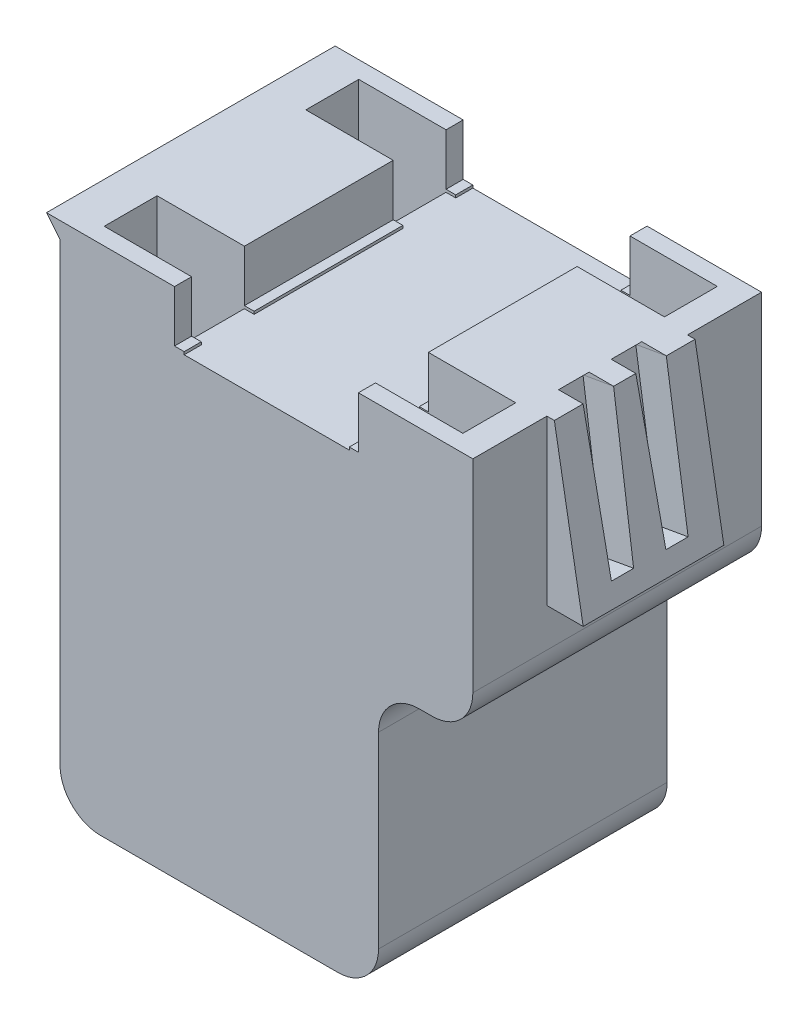
from build123d import *

# Parameters (mm, degrees)
SALIENTE_EXTRUIR1_DEPTH = 21.3
SALIENTE_EXTRUIR2_DEPTH = 21.3
CORTAR_EXTRUIR1_DEPTH   = 5.46
CORTAR_EXTRUIR3_DEPTH   = 5.46
CORTAR_EXTRUIR4_DEPTH   = 2.29
CORTAR_EXTRUIR5_DEPTH   = 4
CROQUIS7_W              = 6.437906951
CROQUIS7_H              = 3.9
CROQUIS7_W_2            = 6.445
CORTAR_EXTRUIR6_DEPTH   = 12
SALIENTE_EXTRUIR3_DEPTH = 21.3
CORTAR_EXTRUIR8_DEPTH   = 0.01
CORTAR_EXTRUIR10_DEPTH  = 0.01
SKETCH1_R               = 3
CUT_EXTRUDE1_DEPTH      = 10


with BuildPart() as part:
    # Croquis1 → Saliente-Extruir1 (new body)
    with BuildSketch(Plane.XY):
        with BuildLine():
            Line((-15.23, 18.9), (-6.785, 18.9))
            Line((-6.785, 18.9), (-6.785, 15.1))
            Line((-6.785, 15.1), (6.785, 15.1))
            Line((6.785, 15.1), (6.785, 18.9))
            Line((6.785, 18.9), (15.23, 18.9))
            Line((15.23, 18.9), (15.23, 3.95))
            ThreePointArc((15.23, 3.95), (14.351320344, 1.828679656), (12.23, 0.95))
            Line((12.23, 0.95), (11.27, 0.95))
            ThreePointArc((11.27, 0.95), (9.148679656, 0.071320344), (8.27, -2.05))
            Line((8.27, -2.05), (8.27, -15.9))
            ThreePointArc((8.27, -15.9), (7.391320344, -18.021320344), (5.27, -18.9))
            Line((5.27, -18.9), (-12.23, -18.9))
            ThreePointArc((-12.23, -18.9), (-14.351320344, -18.021320344), (-15.23, -15.9))
            Line((-15.23, -15.9), (-15.23, 18.9))
        make_face()
    extrude(amount=SALIENTE_EXTRUIR1_DEPTH)

    # Croquis2 → Saliente-Extruir2 (add, through all)
    with BuildSketch(Plane(origin=(0, 0, 0), x_dir=(-1, 0, 0), z_dir=(0, 0, -1))):
        Polygon((-15.23, 18.9), (-15.784402422, 18.9), (-17.91, 6.8), (-15.23, 6.8), align=None)
    extrude(amount=-SALIENTE_EXTRUIR2_DEPTH)

    # Croquis3 → Cortar-Extruir1 (cut)
    with BuildSketch(Plane(origin=(0, 0, 0), x_dir=(-1, 0, 0), z_dir=(0, 0, -1))):
        Polygon((-15.23, 6.8), (-15.23, 18.9), (-15.784402422, 18.9), (-17.91, 6.8), align=None)
    extrude(amount=-CORTAR_EXTRUIR1_DEPTH, mode=Mode.SUBTRACT)

    # Croquis4 → Cortar-Extruir3 (cut)
    with BuildSketch(Plane.XY.offset(21.3)):
        Polygon((17.91, 6.8), (15.23, 6.8), (15.23, 18.9), (15.784402422, 18.9), align=None)
    extrude(amount=-CORTAR_EXTRUIR3_DEPTH, mode=Mode.SUBTRACT)

    # Croquis5 → Cortar-Extruir4 (cut)
    with BuildSketch(Plane(origin=(18.532639468, 3.255614345, 0), x_dir=(0, 0, -1), z_dir=(0.9849183396205656, 0.17301983781944785, 0))):
        Polygon((-13.72, 15.883941872), (-13.72, 16.197349498), (-11.47, 16.197349498), (-11.47, 15.883941872), (-11.84, 5.198659414), (-13.48, 5.198659414), align=None)
        Polygon((-9.83, 15.883941872), (-9.83, 16.197349498), (-7.58, 16.197349498), (-7.58, 15.883941872), (-7.82, 5.198659414), (-9.46, 5.198659414), align=None)
    extrude(amount=-CORTAR_EXTRUIR4_DEPTH, mode=Mode.SUBTRACT)

    # Croquis6 → Cortar-Extruir5 (cut)
    with BuildSketch(Plane(origin=(0, 18.9, 0), x_dir=(1, 0, 0), z_dir=(0, 1, 0))):
        Polygon((13.23, -20.037842324), (13.23, -16.137842324), (6.115382799, -16.137842324), (6.115382799, -5.162157676), (13.23, -5.162157676), (13.23, -1.262157676), (6.115382799, -1.262157676), (6.115382799, 0), (-6.070170326, 0), (-6.070170326, -1.262157676), (-13.23, -1.262157676), (-13.23, -5.162157676), (-6.070170326, -5.162157676), (-6.070170326, -16.137842324), (-13.23, -16.137842324), (-13.23, -20.037842324), (-6.070170326, -20.037842324), (-6.070170326, -21.708109795), (6.115382799, -21.708109795), (6.115382799, -20.037842324), align=None)
    extrude(amount=-CORTAR_EXTRUIR5_DEPTH, mode=Mode.SUBTRACT)

    # Croquis7 → Cortar-Extruir6 (cut)
    with BuildSketch(Plane(origin=(0, 14.9, 0), x_dir=(1, 0, 0), z_dir=(0, 1, 0))):
        with Locations((-10.011046524, -3.212157676)):
            Rectangle(CROQUIS7_W, CROQUIS7_H)
        with Locations((10.0075, -3.212157676)):
            Rectangle(CROQUIS7_W_2, CROQUIS7_H)
        with Locations((10.0075, -18.087842324)):
            Rectangle(CROQUIS7_W_2, CROQUIS7_H)
        with Locations((-10.011046524, -18.087842324)):
            Rectangle(CROQUIS7_W, CROQUIS7_H)
    extrude(amount=-CORTAR_EXTRUIR6_DEPTH, mode=Mode.SUBTRACT)

    # Croquis10 → Saliente-Extruir3 (add, through all)
    with BuildSketch(Plane.XY.offset(21.3)):
        Polygon((-15.23, 18.9), (-16.23, 18.9), (-15.23, 17.671944282), align=None)
    extrude(amount=-SALIENTE_EXTRUIR3_DEPTH)

    # Croquis11 → Cortar-Extruir8 (cut)
    # profile 1 of 6: a face of its own
    with BuildSketch(Plane(origin=(0, 0, 0), x_dir=(-1, 0, 0), z_dir=(0, 0, -1))):
        with BuildLine():
            Line((0.047489316, -3.533287629), (0.204055656, -3.439422028))
            add(Edge.make_bspline(
                [(0.204055656, -3.439422028), (0.21861739, -3.463797765), (0.24651711, -3.510500736), (0.293058037, -3.573608116), (0.341282536, -3.627245591), (0.391547725, -3.671101129), (0.443546789, -3.705628665), (0.497619184, -3.730077346), (0.553582693, -3.745325799), (0.59166884, -3.747177928), (0.610682926, -3.748102583)],
                knots=[0, 0, 0, 0, 1.272034388, 2.437168799, 3.508375237, 4.49857839, 5.41946034, 6.295179144, 7.148887113, 8, 8, 8, 8], degree=3))
            add(Edge.make_bspline(
                [(0.610682926, -3.748102583), (0.62692139, -3.747650319), (0.659114182, -3.746753704), (0.706507536, -3.738138446), (0.752535406, -3.724902862), (0.796249144, -3.705947619), (0.837045573, -3.683014337), (0.872820782, -3.655314484), (0.903748517, -3.624302034), (0.929047507, -3.589703712), (0.948457359, -3.552494221), (0.963375662, -3.514301114), (0.971654514, -3.474524413), (0.972901629, -3.447743043), (0.973530983, -3.434227884)],
                knots=[0, 0, 0, 0, 1.095163259, 2.171163733, 3.241058638, 4.321873601, 5.38011039, 6.391990106, 7.366004449, 8.327778327, 9.272591725, 10.192022065, 11.087607919, 12, 12, 12, 12], degree=3))
            add(Edge.make_bspline(
                [(0.973530983, -3.434227884), (0.972750827, -3.418807517), (0.971164884, -3.387460166), (0.957760309, -3.341211183), (0.936673416, -3.295442198), (0.91721985, -3.267131112), (0.907120142, -3.252432845)],
                knots=[0, 0, 0, 0, 0.938893495, 1.908633276, 2.914225137, 4, 4, 4, 4], degree=3))
            add(Edge.make_bspline(
                [(0.907120142, -3.252432845), (0.898827776, -3.241824734), (0.881418989, -3.219554332), (0.851490639, -3.186404562), (0.816371903, -3.152210649), (0.777264605, -3.115666898), (0.732744179, -3.078472939), (0.684205036, -3.038855141), (0.630407911, -2.99832014), (0.592678594, -2.971135491), (0.573210887, -2.95710866)],
                knots=[0, 0, 0, 0, 0.722233717, 1.516239348, 2.393582979, 3.351407094, 4.387010283, 5.505090956, 6.712668013, 8, 8, 8, 8], degree=3))
            add(Edge.make_bspline(
                [(0.573210887, -2.95710866), (0.553724856, -2.943229365), (0.516469048, -2.916693212), (0.464368048, -2.877310361), (0.417777853, -2.841303814), (0.37690554, -2.808334607), (0.341769087, -2.778398271), (0.312091615, -2.751782278), (0.288629129, -2.72776681), (0.275582217, -2.712187433), (0.269724476, -2.705192677)],
                knots=[0, 0, 0, 0, 1.452282411, 2.77665338, 3.964542531, 5.026858415, 5.96415736, 6.766646006, 7.446254459, 8, 8, 8, 8], degree=3))
            add(Edge.make_bspline(
                [(0.269724476, -2.705192677), (0.261536921, -2.694291295), (0.245434995, -2.672852265), (0.224180483, -2.639342861), (0.206115176, -2.605040549), (0.191953442, -2.569853154), (0.180028026, -2.534274671), (0.172006955, -2.497840887), (0.166984424, -2.460715285), (0.166470081, -2.435731474), (0.166212607, -2.423224862)],
                knots=[0, 0, 0, 0, 1.068054152, 2.10047183, 3.106115577, 4.101338837, 5.06977816, 6.043150881, 7.020423561, 8, 8, 8, 8], degree=3))
            add(Edge.make_bspline(
                [(0.166212607, -2.423224862), (0.16690328, -2.40362994), (0.168269863, -2.364858923), (0.179827137, -2.308221775), (0.198069043, -2.254148129), (0.223625088, -2.203173328), (0.256569604, -2.156624663), (0.294693932, -2.113966693), (0.34010251, -2.078105818), (0.38992494, -2.04677277), (0.444458937, -2.022248051), (0.501604123, -2.003747866), (0.561451324, -1.993265467), (0.601987149, -1.991761171), (0.622555255, -1.990997882)],
                knots=[0, 0, 0, 0, 1.005424448, 1.989358655, 2.955360095, 3.929531133, 4.905563448, 5.876582895, 6.856512386, 7.866279853, 8.892233794, 9.918561126, 10.94386622, 12, 12, 12, 12], degree=3))
            add(Edge.make_bspline(
                [(0.622555255, -1.990997882), (0.644380258, -1.991750649), (0.687783223, -1.993247662), (0.751626767, -2.006263856), (0.813095146, -2.027801295), (0.862542207, -2.052242793), (0.901241626, -2.076654), (0.930754697, -2.098889491), (0.960661848, -2.124487986), (0.991204319, -2.15351767), (1.021864585, -2.186244909), (1.053097828, -2.222445565), (1.084977087, -2.26189841), (1.105485396, -2.290063041), (1.115998932, -2.304501572)],
                knots=[0, 0, 0, 0, 1.286793592, 2.559021753, 3.825965368, 5.121522368, 5.803751409, 6.523245864, 7.299691795, 8.125521123, 9.008227632, 9.944561021, 10.946284179, 12, 12, 12, 12], degree=3))
            Line((1.115998932, -2.304501572), (0.965739767, -2.418401729))
            add(Edge.make_bspline(
                [(0.965739767, -2.418401729), (0.956666711, -2.40671313), (0.939194127, -2.384203622), (0.912667273, -2.352680467), (0.887664864, -2.32388508), (0.863031944, -2.29887395), (0.84006948, -2.276277404), (0.817782546, -2.2569312), (0.796491868, -2.24064578), (0.76965417, -2.223266063), (0.735936877, -2.206038247), (0.693611726, -2.191460193), (0.649380656, -2.182699806), (0.619255393, -2.18154152), (0.604004741, -2.180955147)],
                knots=[0, 0, 0, 0, 1.181633172, 2.275549214, 3.290209073, 4.226197932, 5.078386478, 5.862611352, 6.581680152, 7.217281963, 8.414376989, 9.595101626, 10.782541182, 12, 12, 12, 12], degree=3))
            add(Edge.make_bspline(
                [(0.604004741, -2.180955147), (0.584871914, -2.181596339), (0.547976061, -2.182832815), (0.495593728, -2.196337141), (0.448448192, -2.217600042), (0.407939127, -2.247400051), (0.374211643, -2.282706577), (0.349814171, -2.323335387), (0.335129709, -2.368199409), (0.333337803, -2.399495202), (0.332425214, -2.415433646)],
                knots=[0, 0, 0, 0, 1.14458467, 2.207223713, 3.21896685, 4.227309161, 5.202851033, 6.127160689, 7.046193047, 8, 8, 8, 8], degree=3))
            add(Edge.make_bspline(
                [(0.332425214, -2.415433646), (0.332633243, -2.425356304), (0.333049642, -2.445217844), (0.338857139, -2.474560888), (0.346318034, -2.503829805), (0.35814101, -2.532893005), (0.374463317, -2.56225877), (0.395897306, -2.592432773), (0.42289185, -2.623680969), (0.443570102, -2.644004871), (0.454487597, -2.654735279)],
                knots=[0, 0, 0, 0, 0.858281714, 1.717966888, 2.583508476, 3.4729293, 4.427298488, 5.488583878, 6.674047936, 8, 8, 8, 8], degree=3))
            add(Edge.make_bspline(
                [(0.454487597, -2.654735279), (0.45854174, -2.658353205), (0.468173455, -2.666948569), (0.485781966, -2.681020318), (0.50903503, -2.698378452), (0.537325445, -2.719855907), (0.57117484, -2.744769847), (0.610586939, -2.772801717), (0.655122417, -2.804861522), (0.686725264, -2.827275721), (0.703435497, -2.83912739)],
                knots=[0, 0, 0, 0, 0.420754252, 0.999615792, 1.744751191, 2.668019286, 3.750313428, 4.999500688, 6.413464383, 8, 8, 8, 8], degree=3))
            add(Edge.make_bspline(
                [(0.703435497, -2.83912739), (0.723536376, -2.853754276), (0.762458942, -2.882077213), (0.817840245, -2.924630511), (0.868054885, -2.966248288), (0.913279164, -3.006664772), (0.953959861, -3.045573388), (0.989645655, -3.083442237), (1.020700161, -3.12000002), (1.054132497, -3.166869674), (1.088294343, -3.224432998), (1.117632141, -3.294959399), (1.136130933, -3.365759952), (1.138550027, -3.413346237), (1.13974359, -3.436824956)],
                knots=[0, 0, 0, 0, 1.163667725, 2.253281268, 3.268753668, 4.215851969, 5.092017293, 5.902905408, 6.650798638, 7.335211899, 8.59617414, 9.77448103, 10.901945474, 12, 12, 12, 12], degree=3))
            add(Edge.make_bspline(
                [(1.13974359, -3.436824956), (1.139395854, -3.453429341), (1.138707136, -3.486315664), (1.130790319, -3.534604809), (1.119191163, -3.581505311), (1.10170896, -3.626437441), (1.080371289, -3.670223212), (1.053295816, -3.711714059), (1.021912166, -3.751828278), (0.985910965, -3.789496209), (0.946516675, -3.824075238), (0.904879887, -3.854835199), (0.860932451, -3.880483021), (0.814912775, -3.901412008), (0.766810288, -3.917780994), (0.716641169, -3.929641137), (0.66432272, -3.936920201), (0.628762465, -3.937675725), (0.610682926, -3.938059848)],
                knots=[0, 0, 0, 0, 0.983748083, 1.948392443, 2.894712957, 3.844097841, 4.80183111, 5.778335162, 6.776009319, 7.81870978, 8.863265674, 9.881300176, 10.883814829, 11.87499822, 12.874611388, 13.892143829, 14.928324115, 16, 16, 16, 16], degree=3))
            add(Edge.make_bspline(
                [(0.610682926, -3.938059848), (0.596694224, -3.937789348), (0.568892992, -3.937251754), (0.527771725, -3.93249916), (0.487481192, -3.925774984), (0.448526968, -3.915099539), (0.410407171, -3.902147138), (0.373287593, -3.886198937), (0.337150243, -3.867086918), (0.301792606, -3.845234968), (0.267304605, -3.819804411), (0.23400972, -3.790185103), (0.200815526, -3.75719394), (0.168701779, -3.719935017), (0.137018907, -3.679010281), (0.106391581, -3.634036838), (0.076185839, -3.585259655), (0.057233487, -3.550935214), (0.047489316, -3.533287629)],
                knots=[0, 0, 0, 0, 0.915332311, 1.819136955, 2.706846663, 3.586547465, 4.459518054, 5.340707479, 6.227863349, 7.133153174, 8.059268498, 9.028702269, 10.047606654, 11.120612155, 12.245963614, 13.433783089, 14.680604001, 16, 16, 16, 16], degree=3))
        make_face()
    # profile 2 of 6: a face of its own
    with BuildSketch(Plane(origin=(0, 0, 0), x_dir=(-1, 0, 0), z_dir=(0, 0, -1))):
        with BuildLine():
            Line((3.229273504, -2.378332618), (3.083837473, -2.489635703))
            add(Edge.make_bspline(
                [(3.083837473, -2.489635703), (3.073462691, -2.47727121), (3.052853, -2.452708926), (3.019695839, -2.418218084), (2.985140386, -2.385904383), (2.949199851, -2.355613888), (2.911227317, -2.32840585), (2.872142644, -2.302862391), (2.831292012, -2.279966546), (2.774802553, -2.252204883), (2.700905566, -2.223235042), (2.607880797, -2.198944583), (2.510772841, -2.18348171), (2.444522444, -2.181806982), (2.41082482, -2.180955147)],
                knots=[0, 0, 0, 0, 0.757959112, 1.505699292, 2.245454638, 2.979532153, 3.711538275, 4.438200793, 5.171680507, 5.909471876, 7.393775596, 8.890124382, 10.418191784, 12, 12, 12, 12], degree=3))
            add(Edge.make_bspline(
                [(2.41082482, -2.180955147), (2.392259907, -2.181168911), (2.355302382, -2.181594454), (2.300455065, -2.187208449), (2.246631908, -2.195098965), (2.193867924, -2.206806948), (2.142230275, -2.221609126), (2.091381379, -2.239296741), (2.042057437, -2.261180343), (1.993576119, -2.285367631), (1.947126287, -2.312687154), (1.903176324, -2.342486302), (1.861886524, -2.374431616), (1.823224225, -2.408642826), (1.787149903, -2.444965864), (1.753924951, -2.483787828), (1.723664338, -2.524984603), (1.695768245, -2.568012948), (1.670784841, -2.612747529), (1.649866946, -2.659353921), (1.631343402, -2.707034009), (1.616685886, -2.756326498), (1.605084163, -2.806884545), (1.597079108, -2.858843837), (1.591528958, -2.912095826), (1.591105531, -2.94818992), (1.590892094, -2.966383917)],
                knots=[0, 0, 0, 0, 1.054917814, 2.100044995, 3.131103042, 4.146048494, 5.169673617, 6.183595914, 7.203665975, 8.234915748, 9.262203917, 10.264457458, 11.251630812, 12.227803204, 13.197192746, 14.159520551, 15.12972552, 16.100847026, 17.073214652, 18.039054194, 19.002613845, 19.979014051, 20.95965708, 21.949030935, 22.966165397, 24, 24, 24, 24], degree=3))
            add(Edge.make_bspline(
                [(1.590892094, -2.966383917), (1.591559807, -2.993758407), (1.592870772, -3.047504587), (1.604538015, -3.126229035), (1.622267793, -3.201646225), (1.648840202, -3.273284725), (1.6816057, -3.342027898), (1.723008023, -3.406712624), (1.770959274, -3.46831639), (1.826137821, -3.525383283), (1.886677565, -3.577513463), (1.951631669, -3.623418979), (2.020838354, -3.661685604), (2.093533488, -3.693528709), (2.170276473, -3.718006227), (2.250929306, -3.735238076), (2.33531657, -3.74647873), (2.392979544, -3.74755489), (2.422326138, -3.748102583)],
                knots=[0, 0, 0, 0, 1.029171465, 2.020641659, 2.987623507, 3.938342917, 4.889210282, 5.84687017, 6.821220943, 7.821438502, 8.827599549, 9.822697543, 10.807740252, 11.797342354, 12.80366471, 13.83203677, 14.896651826, 16, 16, 16, 16], degree=3))
            add(Edge.make_bspline(
                [(2.422326138, -3.748102583), (2.454659645, -3.747208937), (2.51829972, -3.745450028), (2.6116278, -3.730549092), (2.70097006, -3.706388444), (2.786331304, -3.672575793), (2.867470887, -3.628620412), (2.944515787, -3.575334452), (3.017531034, -3.512211042), (3.061436671, -3.464012887), (3.083837473, -3.439422028)],
                knots=[0, 0, 0, 0, 1.028121516, 2.023589091, 2.998037872, 3.967518031, 4.937445131, 5.927275754, 6.942489185, 8, 8, 8, 8], degree=3))
            Line((3.083837473, -3.439422028), (3.229273504, -3.549612082))
            add(Edge.make_bspline(
                [(3.229273504, -3.549612082), (3.217569338, -3.564713679), (3.194217067, -3.594844538), (3.156403866, -3.637321651), (3.11656963, -3.67727587), (3.074418483, -3.71438507), (3.030435319, -3.749391808), (2.983830387, -3.781301527), (2.935216357, -3.81055962), (2.884757945, -3.837349701), (2.832508763, -3.861118411), (2.778531416, -3.881466863), (2.72305857, -3.89899545), (2.666087688, -3.913416267), (2.6075006, -3.924672215), (2.547508724, -3.932196793), (2.485982582, -3.937351889), (2.444473997, -3.937821745), (2.423439169, -3.938059848)],
                knots=[0, 0, 0, 0, 0.986787822, 1.968848986, 2.935600012, 3.899624008, 4.868462664, 5.837806735, 6.815139263, 7.798259679, 8.787526145, 9.778297419, 10.776456485, 11.791383307, 12.812564526, 13.85620153, 14.913611965, 16, 16, 16, 16], degree=3))
            add(Edge.make_bspline(
                [(2.423439169, -3.938059848), (2.403519396, -3.93792121), (2.36413051, -3.937647071), (2.305975753, -3.933206216), (2.249360434, -3.927147397), (2.194446361, -3.918024494), (2.140933866, -3.907258948), (2.089308056, -3.892827908), (2.039060924, -3.876662307), (1.990394344, -3.857662585), (1.943266919, -3.836222772), (1.897830653, -3.811991405), (1.85410644, -3.785172252), (1.811664405, -3.756356475), (1.771131517, -3.724618487), (1.732156527, -3.690399059), (1.694520883, -3.653813528), (1.671236129, -3.627432002), (1.659528996, -3.614167871)],
                knots=[0, 0, 0, 0, 1.114604814, 2.203992996, 3.262667896, 4.300477797, 5.318619304, 6.316056647, 7.298880507, 8.271930387, 9.238335007, 10.195173496, 11.151986948, 12.108099108, 13.064862484, 14.031167946, 15.010108607, 16, 16, 16, 16], degree=3))
            add(Edge.make_bspline(
                [(1.659528996, -3.614167871), (1.640777635, -3.591127325), (1.603501295, -3.545324399), (1.555809788, -3.471089734), (1.514985873, -3.39358364), (1.481978615, -3.312398928), (1.456175002, -3.227717769), (1.43829912, -3.139497476), (1.426683062, -3.04782044), (1.425354701, -2.985465139), (1.424679487, -2.953769567)],
                knots=[0, 0, 0, 0, 0.994628077, 1.977248131, 2.950237994, 3.925870899, 4.908910175, 5.911660606, 6.938484602, 8, 8, 8, 8], degree=3))
            add(Edge.make_bspline(
                [(1.424679487, -2.953769567), (1.425502444, -2.92045564), (1.427121559, -2.854912567), (1.440877668, -2.75872385), (1.463006781, -2.666568735), (1.494437634, -2.578619253), (1.534286716, -2.494412813), (1.583513299, -2.414592676), (1.641545495, -2.338648369), (1.707928167, -2.26773223), (1.780724215, -2.202888489), (1.858680421, -2.14584104), (1.941644201, -2.098365521), (2.028701564, -2.058680052), (2.120504404, -2.028176523), (2.216856853, -2.006822962), (2.317577862, -1.993531821), (2.386296729, -1.991851607), (2.421213108, -1.990997882)],
                knots=[0, 0, 0, 0, 1.032925535, 2.032216505, 3.007276963, 3.968222605, 4.92396291, 5.891752235, 6.871517503, 7.883894988, 8.900124299, 9.891468569, 10.874487609, 11.85992873, 12.854644235, 13.869047385, 14.917252991, 16, 16, 16, 16], degree=3))
            add(Edge.make_bspline(
                [(2.421213108, -1.990997882), (2.442493266, -1.991253014), (2.484615196, -1.991758021), (2.546925974, -1.996682521), (2.607590872, -2.004891804), (2.666651683, -2.016065725), (2.724395735, -2.029933766), (2.780381695, -2.047999673), (2.834938084, -2.068656505), (2.887720823, -2.092447026), (2.938476664, -2.119152343), (2.987189799, -2.148476444), (3.033473287, -2.180382975), (3.077652802, -2.214600572), (3.118989297, -2.251853143), (3.158656413, -2.291116037), (3.195307067, -2.333520186), (3.217930633, -2.363367797), (3.229273504, -2.378332618)],
                knots=[0, 0, 0, 0, 1.096760587, 2.17092713, 3.219439832, 4.250915756, 5.268269357, 6.278326846, 7.281116186, 8.274029601, 9.260640565, 10.235837813, 11.203064059, 12.156899882, 13.114053108, 14.069676657, 15.032185724, 16, 16, 16, 16], degree=3))
        make_face()
    # profile 3 of 6: a face of its own
    with BuildSketch(Plane(origin=(0, 0, 0), x_dir=(-1, 0, 0), z_dir=(0, 0, -1))):
        Polygon((3.395486111, -2.228444464), (3.395486111, -2.038487199), (4.369017094, -2.038487199), (4.369017094, -2.228444464), (3.965357906, -2.228444464), (3.965357906, -3.890570532), (3.799145299, -3.890570532), (3.799145299, -2.228444464), align=None)
    # profile 4 of 6: a face of its own
    with BuildSketch(Plane(origin=(0, 0, 0), x_dir=(-1, 0, 0), z_dir=(0, 0, -1))):
        with BuildLine():
            add(Edge.make_bspline(
                [(4.487740385, -2.965270886), (4.487913961, -2.935586018), (4.488251135, -2.877922735), (4.492002091, -2.793899195), (4.49823321, -2.715074375), (4.50677257, -2.641444503), (4.517164334, -2.572990569), (4.531036696, -2.50989551), (4.546812637, -2.451867302), (4.56509664, -2.398716718), (4.585727678, -2.349727683), (4.608182475, -2.303994348), (4.633352178, -2.261585908), (4.659798295, -2.221825494), (4.688591349, -2.185363956), (4.718911959, -2.15168638), (4.751943535, -2.121571108), (4.786563211, -2.094135773), (4.823084423, -2.070085428), (4.860466167, -2.048901437), (4.898965744, -2.030804007), (4.938688266, -2.016574485), (4.979276703, -2.004821245), (5.020872942, -1.99678376), (5.063545664, -1.991726563), (5.092348965, -1.99124308), (5.106956547, -1.990997882)],
                knots=[0, 0, 0, 0, 1.646270934, 3.197905019, 4.663502075, 6.030701355, 7.308322542, 8.50163776, 9.611534131, 10.641858119, 11.616356847, 12.558055219, 13.465016945, 14.349605745, 15.204443733, 16.039544428, 16.859896111, 17.680448484, 18.487036065, 19.28249412, 20.06191084, 20.843045899, 21.620316918, 22.403196591, 23.190181807, 24, 24, 24, 24], degree=3))
            add(Edge.make_bspline(
                [(5.106956547, -1.990997882), (5.121686155, -1.991256018), (5.150978709, -1.991769368), (5.194285908, -1.996703288), (5.236592614, -2.00489009), (5.277718463, -2.01648994), (5.318001268, -2.030880985), (5.35712595, -2.048918751), (5.395335531, -2.069915485), (5.432022808, -2.094587287), (5.467590542, -2.122094575), (5.501165089, -2.15318982), (5.532749506, -2.187559047), (5.562740188, -2.224834533), (5.590286275, -2.265731224), (5.616518883, -2.309537815), (5.639999085, -2.357020398), (5.662612851, -2.407386729), (5.682132215, -2.462030415), (5.699735603, -2.520643434), (5.713959057, -2.583918108), (5.725806714, -2.651522454), (5.734985054, -2.723704748), (5.741669827, -2.800310256), (5.745201002, -2.88138938), (5.745866006, -2.936823741), (5.746207265, -2.965270886)],
                knots=[0, 0, 0, 0, 0.810914788, 1.612654377, 2.396697861, 3.181598691, 3.963628158, 4.749916497, 5.551656086, 6.361998678, 7.18212741, 8.025565596, 8.878627764, 9.750805457, 10.657531673, 11.591944965, 12.560506719, 13.57287815, 14.630710178, 15.753379473, 16.941251878, 18.199788006, 19.531962791, 20.947069417, 22.433333509, 24, 24, 24, 24], degree=3))
            add(Edge.make_bspline(
                [(5.746207265, -2.965270886), (5.745862468, -2.993593954), (5.745190646, -3.048780297), (5.741709413, -3.129494604), (5.734852138, -3.205693569), (5.726274352, -3.277559939), (5.714394051, -3.344794595), (5.699786317, -3.407630199), (5.683567188, -3.466338104), (5.663546276, -3.520437358), (5.641633108, -3.570682645), (5.6177914, -3.617602344), (5.592248618, -3.661611174), (5.564420407, -3.702356874), (5.534758809, -3.74012808), (5.502628979, -3.774258072), (5.468936628, -3.805569219), (5.433264224, -3.833430705), (5.396004778, -3.857817248), (5.357926434, -3.879626243), (5.31835356, -3.897211878), (5.278182956, -3.91231167), (5.236840029, -3.923847743), (5.194376314, -3.931824325), (5.151007805, -3.937418595), (5.121691144, -3.937845357), (5.106956547, -3.938059848)],
                knots=[0, 0, 0, 0, 1.561518951, 3.042555995, 4.452378317, 5.7783523, 7.031515105, 8.214008947, 9.334062868, 10.386615937, 11.391082383, 12.354592575, 13.286541444, 14.194233754, 15.072674879, 15.931287219, 16.775624067, 17.606195743, 18.42308326, 19.229000347, 20.022332153, 20.807536673, 21.593273796, 22.3848459, 23.188221202, 24, 24, 24, 24], degree=3))
            add(Edge.make_bspline(
                [(5.106956547, -3.938059848), (5.09234937, -3.937813068), (5.063546868, -3.937326467), (5.020868293, -3.932292117), (4.979443834, -3.924198247), (4.939069076, -3.912865294), (4.899536879, -3.898993276), (4.861385927, -3.880920285), (4.824192028, -3.860106007), (4.788054413, -3.836401763), (4.753652144, -3.809244039), (4.720791632, -3.77920627), (4.690298393, -3.745538881), (4.661917017, -3.708773481), (4.634943229, -3.669248306), (4.610130935, -3.626423709), (4.587180525, -3.580469494), (4.566202511, -3.531088767), (4.54760301, -3.477560951), (4.531173598, -3.419273677), (4.518201523, -3.355712486), (4.507098043, -3.287387879), (4.498142223, -3.214006258), (4.492028059, -3.135527784), (4.488249113, -3.052001361), (4.487913055, -2.994708605), (4.487740385, -2.965270886)],
                knots=[0, 0, 0, 0, 0.810891512, 1.598919785, 2.382837074, 3.152667961, 3.926044502, 4.706494248, 5.493654104, 6.291793342, 7.103789334, 7.925228297, 8.761435821, 9.622817696, 10.50288917, 11.416980706, 12.369136599, 13.353924996, 14.394355917, 15.514179734, 16.714354668, 17.994756427, 19.357759367, 20.818452758, 22.365282078, 24, 24, 24, 24], degree=3))
        make_face()
        with BuildLine():
            add(Edge.make_bspline(
                [(4.653952991, -2.964528865), (4.654016199, -2.989266718), (4.654138872, -3.037278034), (4.657343611, -3.107045093), (4.661709359, -3.172116892), (4.667340379, -3.232576055), (4.675702773, -3.288217936), (4.685072615, -3.339425227), (4.696475145, -3.385926932), (4.709966259, -3.428042148), (4.725332781, -3.466485614), (4.742110467, -3.502257923), (4.760134266, -3.535781656), (4.78030565, -3.566755691), (4.802274038, -3.595281036), (4.825543221, -3.621862576), (4.85098163, -3.645567646), (4.886173194, -3.673998106), (4.932632161, -3.703376981), (4.991168819, -3.72896012), (5.051318374, -3.745037504), (5.092144244, -3.747082075), (5.112521701, -3.748102583)],
                knots=[0, 0, 0, 0, 1.459021318, 2.831673884, 4.118529203, 5.306027144, 6.411944654, 7.436330062, 8.375795394, 9.233974572, 10.042671642, 10.816086306, 11.563610507, 12.285937304, 12.993564865, 13.685989202, 14.367179055, 15.041617293, 16.353048772, 17.594441528, 18.799311195, 20, 20, 20, 20], degree=3))
            add(Edge.make_bspline(
                [(5.112521701, -3.748102583), (5.133030969, -3.747257091), (5.174007161, -3.745567852), (5.233873794, -3.729270187), (5.291992312, -3.704680055), (5.337538714, -3.675603667), (5.372189893, -3.647913259), (5.397016801, -3.624304675), (5.419803801, -3.597869695), (5.441416066, -3.569347984), (5.46123816, -3.538194628), (5.479263237, -3.504559432), (5.495711508, -3.468348992), (5.505082545, -3.443070838), (5.509873715, -3.430146771)],
                knots=[0, 0, 0, 0, 1.353760809, 2.704726607, 4.075137775, 5.516104923, 6.260822281, 7.007110065, 7.778089737, 8.566572457, 9.372053459, 10.217411131, 11.088608312, 12, 12, 12, 12], degree=3))
            add(Edge.make_bspline(
                [(5.509873715, -3.430146771), (5.515457358, -3.413621033), (5.52679455, -3.3800667), (5.54140578, -3.328015934), (5.552912721, -3.273404471), (5.563265002, -3.21655868), (5.570330994, -3.157059339), (5.576018379, -3.095090544), (5.579368367, -3.030605573), (5.579783631, -2.986793223), (5.579994658, -2.964528865)],
                knots=[0, 0, 0, 0, 0.884706709, 1.796334032, 2.740027952, 3.714592787, 4.726048262, 5.777819803, 6.87074269, 8, 8, 8, 8], degree=3))
            add(Edge.make_bspline(
                [(5.579994658, -2.964528865), (5.579703516, -2.942268108), (5.579133981, -2.898721308), (5.576956996, -2.834947105), (5.571335354, -2.774374581), (5.565091654, -2.716742789), (5.555885624, -2.662370754), (5.545959618, -2.610803301), (5.532623977, -2.562679284), (5.518378929, -2.517245255), (5.502075095, -2.475017409), (5.484128019, -2.435798863), (5.464960671, -2.39940028), (5.444142069, -2.365921523), (5.421919353, -2.335212636), (5.397705984, -2.30788933), (5.37246242, -2.283104767), (5.337104992, -2.254814158), (5.290816514, -2.225968386), (5.233219025, -2.199422338), (5.173279976, -2.18417795), (5.132759857, -2.18202864), (5.112521701, -2.180955147)],
                knots=[0, 0, 0, 0, 1.31362396, 2.569729283, 3.763502607, 4.902122613, 5.988968491, 7.01645872, 7.998833611, 8.933434873, 9.825090667, 10.667526885, 11.477055099, 12.250526234, 12.991942729, 13.710640831, 14.402115721, 15.076753259, 16.378508321, 17.609869233, 18.806226677, 20, 20, 20, 20], degree=3))
            add(Edge.make_bspline(
                [(5.112521701, -2.180955147), (5.092037346, -2.182030121), (5.051031319, -2.184182027), (4.990469276, -2.199365541), (4.93241739, -2.225830735), (4.886251316, -2.254909699), (4.850869229, -2.282605389), (4.825954637, -2.306622387), (4.802593954, -2.33289353), (4.781073963, -2.36168121), (4.760918384, -2.392619134), (4.742407598, -2.425950688), (4.725729678, -2.461844785), (4.710339111, -2.500270982), (4.696806844, -2.542382565), (4.685644622, -2.588826991), (4.675332723, -2.639871409), (4.668032726, -2.695814649), (4.661543155, -2.756288955), (4.657372609, -2.821523202), (4.654128152, -2.89140727), (4.654012548, -2.939666825), (4.653952991, -2.964528865)],
                knots=[0, 0, 0, 0, 1.207732386, 2.417664972, 3.655092373, 4.956220595, 5.625982001, 6.301752483, 6.994047911, 7.697131622, 8.419323945, 9.170223765, 9.943494443, 10.752040957, 11.610060368, 12.549350801, 13.567764191, 14.679664412, 15.874934091, 17.154273443, 18.533957287, 20, 20, 20, 20], degree=3))
        make_face(mode=Mode.SUBTRACT)
    # profile 5 of 6: a face of its own
    with BuildSketch(Plane(origin=(0, 0, 0), x_dir=(-1, 0, 0), z_dir=(0, 0, -1))):
        Polygon((6.306061782, -2.038487199), (6.648504274, -2.038487199), (6.648504274, -3.890570532), (6.482291667, -3.890570532), (6.482291667, -2.228444464), (6.197355769, -2.228444464), align=None)
    # profile 6 of 6: a face of its own
    with BuildSketch(Plane(origin=(0, 0, 0), x_dir=(-1, 0, 0), z_dir=(0, 0, -1))):
        with BuildLine():
            Line((7.57454594, -2.465891045), (7.408333333, -2.465891045))
            add(Edge.make_bspline(
                [(7.408333333, -2.465891045), (7.412836304, -2.447247189), (7.421639243, -2.410799975), (7.440000042, -2.358726133), (7.460002148, -2.309448269), (7.484020549, -2.263889097), (7.510218932, -2.221133011), (7.540234705, -2.182149766), (7.572683058, -2.145947905), (7.608573761, -2.113820483), (7.646212678, -2.084728102), (7.686130164, -2.059923384), (7.727523112, -2.038585186), (7.770678311, -2.021006147), (7.815724244, -2.007763474), (7.86225367, -1.998155498), (7.910388522, -1.991916033), (7.943063288, -1.991307088), (7.959654614, -1.990997882)],
                knots=[0, 0, 0, 0, 1.162005537, 2.271625781, 3.343758855, 4.383309926, 5.390229558, 6.379919256, 7.361854164, 8.333198761, 9.295911338, 10.242430842, 11.177959212, 12.116337295, 13.062827104, 14.020064771, 14.994644689, 16, 16, 16, 16], degree=3))
            add(Edge.make_bspline(
                [(7.959654614, -1.990997882), (7.983828398, -1.991727725), (8.031648667, -1.99317149), (8.101902446, -2.00635538), (8.169649971, -2.027217846), (8.234149698, -2.056043526), (8.294061118, -2.091596813), (8.347367351, -2.133911486), (8.393345854, -2.182171116), (8.431919129, -2.235475432), (8.462121316, -2.292443139), (8.484392022, -2.351074889), (8.497950161, -2.411231598), (8.499707289, -2.451848992), (8.500587607, -2.47219822)],
                knots=[0, 0, 0, 0, 1.083050992, 2.142477498, 3.193116406, 4.255571735, 5.30263384, 6.308962982, 7.297363603, 8.282367274, 9.249857812, 10.179914175, 11.08814088, 12, 12, 12, 12], degree=3))
            add(Edge.make_bspline(
                [(8.500587607, -2.47219822), (8.499971873, -2.491780982), (8.498766978, -2.530101408), (8.488536226, -2.586045701), (8.47131912, -2.638772714), (8.447469704, -2.688504412), (8.4165973, -2.734925474), (8.379199665, -2.778140341), (8.33501284, -2.818340687), (8.301527735, -2.841369741), (8.284288612, -2.85322578)],
                knots=[0, 0, 0, 0, 1.024540389, 2.004866551, 2.965041327, 3.920577974, 4.882998113, 5.874504559, 6.905732034, 8, 8, 8, 8], degree=3))
            add(Edge.make_bspline(
                [(8.284288612, -2.85322578), (8.303990415, -2.862739229), (8.343025386, -2.881588124), (8.396233375, -2.918553462), (8.444534584, -2.961234112), (8.471471135, -2.994541266), (8.485005175, -3.011276161)],
                knots=[0, 0, 0, 0, 1.015518401, 2.012035669, 3.001164323, 4, 4, 4, 4], degree=3))
            add(Edge.make_bspline(
                [(8.485005175, -3.011276161), (8.493917052, -3.023477554), (8.511594868, -3.047680535), (8.533415338, -3.086593561), (8.553210994, -3.12593789), (8.568636318, -3.166768076), (8.580581656, -3.208610879), (8.589120307, -3.251538147), (8.594424748, -3.295584934), (8.595184394, -3.325383621), (8.595566239, -3.340362282)],
                knots=[0, 0, 0, 0, 1.025084078, 2.033381695, 3.024893161, 4.013698104, 4.991890475, 5.976764909, 6.982997093, 8, 8, 8, 8], degree=3))
            add(Edge.make_bspline(
                [(8.595566239, -3.340362282), (8.594616643, -3.366296593), (8.592721918, -3.418043167), (8.575786429, -3.494494374), (8.549532755, -3.569226202), (8.512249293, -3.640703305), (8.46681107, -3.70757959), (8.412752819, -3.767415803), (8.350688762, -3.818850065), (8.281470772, -3.86182381), (8.206478792, -3.896176211), (8.126270041, -3.920019108), (8.042000221, -3.935548033), (7.984211359, -3.937213251), (7.95483148, -3.938059848)],
                knots=[0, 0, 0, 0, 0.955779014, 1.907060117, 2.875433937, 3.871313158, 4.872415639, 5.851225146, 6.836215519, 7.83643374, 8.849228613, 9.86973379, 10.916971861, 12, 12, 12, 12], degree=3))
            add(Edge.make_bspline(
                [(7.95483148, -3.938059848), (7.935030434, -3.937600419), (7.896068578, -3.936696415), (7.838789726, -3.930516488), (7.784115327, -3.91922936), (7.731971457, -3.904040528), (7.682311791, -3.884783231), (7.635287869, -3.860802087), (7.590610384, -3.832591417), (7.548700939, -3.799818227), (7.50956453, -3.763156851), (7.474241213, -3.721956458), (7.442142073, -3.676978665), (7.414126593, -3.627701048), (7.388918706, -3.574760433), (7.36818545, -3.517478936), (7.349936836, -3.456368641), (7.341452462, -3.413782503), (7.337099359, -3.391932711)],
                knots=[0, 0, 0, 0, 1.048658725, 2.063410685, 3.046034179, 4.001477787, 4.936774919, 5.862367409, 6.792675028, 7.730719943, 8.675894397, 9.627829632, 10.600096036, 11.597688215, 12.626045268, 13.701542398, 14.82072376, 16, 16, 16, 16], degree=3))
            Line((7.337099359, -3.391932711), (7.503311966, -3.391932711))
            add(Edge.make_bspline(
                [(7.503311966, -3.391932711), (7.507642291, -3.406193231), (7.516065149, -3.43393118), (7.530402549, -3.473851675), (7.546737009, -3.510447812), (7.56426013, -3.543988047), (7.582663724, -3.574802693), (7.603256205, -3.602076932), (7.624512378, -3.627008727), (7.640535203, -3.641055251), (7.648376987, -3.647929807)],
                knots=[0, 0, 0, 0, 1.198163088, 2.33053128, 3.407730985, 4.417276592, 5.372219308, 6.28897303, 7.162600585, 8, 8, 8, 8], degree=3))
            add(Edge.make_bspline(
                [(7.648376987, -3.647929807), (7.658746842, -3.655924633), (7.679454542, -3.671889609), (7.713198565, -3.692263387), (7.748687067, -3.70991693), (7.786688999, -3.723402052), (7.826384315, -3.734820231), (7.868414629, -3.742292339), (7.912409131, -3.747418996), (7.942448739, -3.747871397), (7.957799563, -3.748102583)],
                knots=[0, 0, 0, 0, 0.946170439, 1.889420265, 2.845303464, 3.807233317, 4.801018734, 5.828864929, 6.890507805, 8, 8, 8, 8], degree=3))
            add(Edge.make_bspline(
                [(7.957799563, -3.748102583), (7.975131624, -3.747776667), (8.009022975, -3.747139365), (8.058476172, -3.74127847), (8.105523029, -3.732742793), (8.149641202, -3.719559673), (8.191408596, -3.703271472), (8.230239719, -3.682820025), (8.266644325, -3.658825109), (8.300156135, -3.631552305), (8.3302898, -3.60169593), (8.356821959, -3.57046818), (8.379377509, -3.53800072), (8.397572152, -3.504113881), (8.411939319, -3.468947989), (8.421720012, -3.432404359), (8.428520606, -3.394782055), (8.429074438, -3.369207976), (8.429353632, -3.356315724)],
                knots=[0, 0, 0, 0, 1.217147791, 2.380027433, 3.494444702, 4.572153297, 5.609568379, 6.639424714, 7.649109417, 8.668170816, 9.669597737, 10.625200337, 11.543417969, 12.441394052, 13.322311151, 14.205496177, 15.095365482, 16, 16, 16, 16], degree=3))
            add(Edge.make_bspline(
                [(8.429353632, -3.356315724), (8.428543848, -3.339058891), (8.426928308, -3.304631091), (8.414594185, -3.253980542), (8.394306536, -3.205178986), (8.365904832, -3.159059047), (8.331331342, -3.116315132), (8.290921579, -3.078177306), (8.244339975, -3.046707716), (8.201466961, -3.024964969), (8.163491232, -3.010128683), (8.130992258, -3.000246515), (8.094608555, -2.991878455), (8.054780112, -2.984093212), (8.011206827, -2.977467332), (7.963936137, -2.971941871), (7.912958463, -2.967520662), (7.877667721, -2.96554629), (7.859481838, -2.964528865)],
                knots=[0, 0, 0, 0, 1.07054697, 2.135767047, 3.216561865, 4.33974944, 5.486079747, 6.621378074, 7.775625952, 8.963672916, 9.598146892, 10.304877434, 11.070270905, 11.915000392, 12.823868403, 13.805723172, 14.86925407, 16, 16, 16, 16], degree=3))
            Line((7.859481838, -2.964528865), (7.859481838, -2.7745716))
            add(Edge.make_bspline(
                [(7.859481838, -2.7745716), (7.882395371, -2.774182767), (7.927277355, -2.773421137), (7.992838091, -2.764209398), (8.055530218, -2.751466733), (8.113964369, -2.731948318), (8.167224314, -2.709278661), (8.213430936, -2.682898534), (8.251936885, -2.653574896), (8.282555035, -2.62085514), (8.305589252, -2.585763427), (8.322430933, -2.549189196), (8.332379439, -2.51081188), (8.333707471, -2.484620952), (8.334375, -2.471456199)],
                knots=[0, 0, 0, 0, 1.321986639, 2.589447074, 3.816329219, 5.01088745, 6.139805852, 7.153945165, 8.075214402, 8.924034688, 9.728124013, 10.488707548, 11.240355623, 12, 12, 12, 12], degree=3))
            add(Edge.make_bspline(
                [(8.334375, -2.471456199), (8.334155708, -2.461784226), (8.333719436, -2.442542293), (8.328217543, -2.414430277), (8.319949821, -2.387177694), (8.308583464, -2.360900436), (8.293369817, -2.335780749), (8.275163316, -2.311604474), (8.253484363, -2.288509641), (8.228642398, -2.266982972), (8.201966151, -2.246467584), (8.172729811, -2.229050784), (8.141814903, -2.214157356), (8.109187198, -2.201875661), (8.074740813, -2.192636787), (8.038637593, -2.186003238), (8.000808694, -2.181855812), (7.975000319, -2.181258692), (7.961880676, -2.180955147)],
                knots=[0, 0, 0, 0, 0.884392785, 1.759457502, 2.611959086, 3.489218968, 4.37281399, 5.2945488, 6.255912374, 7.266815255, 8.301784654, 9.332968512, 10.37626691, 11.440494194, 12.520033166, 13.637162961, 14.798855837, 16, 16, 16, 16], degree=3))
            add(Edge.make_bspline(
                [(7.961880676, -2.180955147), (7.940792501, -2.18169141), (7.899602392, -2.183129501), (7.840221999, -2.195725263), (7.785019684, -2.215821999), (7.74282464, -2.239810721), (7.711665945, -2.263491159), (7.689400231, -2.284172255), (7.667534795, -2.307155458), (7.647508124, -2.333856348), (7.627254811, -2.362466691), (7.608816231, -2.394440889), (7.59089881, -2.428944881), (7.580102461, -2.453337155), (7.57454594, -2.465891045)],
                knots=[0, 0, 0, 0, 1.472543308, 2.876219568, 4.221790263, 5.565193594, 6.249813518, 6.953379497, 7.687249741, 8.463570142, 9.283606569, 10.136032583, 11.040678096, 12, 12, 12, 12], degree=3))
        make_face()
    extrude(amount=-CORTAR_EXTRUIR8_DEPTH, mode=Mode.SUBTRACT)

    # Croquis13 → Cortar-Extruir10 (cut)
    # profile 1 of 10: a face of its own
    with BuildSketch(Plane(origin=(0, 0, 0), x_dir=(-1, 0, 0), z_dir=(0, 0, -1))):
        Polygon((-2.805188759, -5.997595629), (-2.511666623, -5.997595629), (-2.511666623, -7.585095629), (-2.654134572, -7.585095629), (-2.654134572, -6.160416142), (-2.898365341, -6.160416142), align=None)
    # profile 2 of 10: a face of its own
    with BuildSketch(Plane(origin=(0, 0, 0), x_dir=(-1, 0, 0), z_dir=(0, 0, -1))):
        with BuildLine():
            add(Edge.make_bspline(
                [(-1.921442264, -6.791981646), (-1.921293485, -6.766537474), (-1.921004478, -6.717111803), (-1.917789373, -6.645091626), (-1.912448414, -6.577527495), (-1.905128963, -6.514416175), (-1.896221736, -6.455741375), (-1.88433114, -6.401659896), (-1.870808905, -6.351921432), (-1.855136903, -6.306363788), (-1.837453155, -6.264373187), (-1.818206187, -6.225173185), (-1.796632155, -6.188823094), (-1.773964056, -6.154742739), (-1.749284295, -6.123489992), (-1.7232952, -6.094623499), (-1.694982421, -6.068810408), (-1.665308413, -6.045294407), (-1.634004517, -6.024679825), (-1.601963022, -6.006522119), (-1.568963385, -5.991010036), (-1.534915509, -5.978813303), (-1.50012542, -5.968739097), (-1.464471501, -5.961849824), (-1.427894882, -5.957515084), (-1.403206338, -5.95710067), (-1.390685554, -5.956890501)],
                knots=[0, 0, 0, 0, 1.646270934, 3.197905019, 4.663502075, 6.030701355, 7.308322542, 8.50163776, 9.611534131, 10.641858119, 11.616356847, 12.558055219, 13.465016945, 14.349605745, 15.204443733, 16.039544428, 16.859896111, 17.680448484, 18.487036065, 19.28249412, 20.06191084, 20.843045899, 21.620316918, 22.403196591, 23.190181807, 24, 24, 24, 24], degree=3))
            add(Edge.make_bspline(
                [(-1.390685554, -5.956890501), (-1.378060176, -5.95711176), (-1.352952272, -5.957551774), (-1.315831816, -5.961780848), (-1.279568925, -5.968798108), (-1.244318197, -5.978740835), (-1.209790079, -5.991076017), (-1.176254636, -6.00653696), (-1.143503567, -6.02453416), (-1.11205733, -6.045681419), (-1.081570701, -6.069259094), (-1.052792517, -6.095912162), (-1.025720161, -6.125371499), (-1.000013861, -6.157321916), (-0.97640293, -6.192376222), (-0.953917837, -6.229924729), (-0.93379195, -6.270624085), (-0.914408722, -6.313795226), (-0.897677839, -6.360632671), (-0.88258922, -6.410872402), (-0.870397688, -6.465107837), (-0.860242554, -6.523054419), (-0.852375405, -6.584924956), (-0.846645599, -6.650586821), (-0.843618878, -6.720083212), (-0.843048875, -6.76759838), (-0.842756367, -6.791981646)],
                knots=[0, 0, 0, 0, 0.810914788, 1.612654377, 2.396697861, 3.181598691, 3.963628158, 4.749916497, 5.551656086, 6.361998678, 7.18212741, 8.025565596, 8.878627764, 9.750805457, 10.657531673, 11.591944965, 12.560506719, 13.57287815, 14.630710178, 15.753379473, 16.941251878, 18.199788006, 19.531962791, 20.947069417, 22.433333509, 24, 24, 24, 24], degree=3))
            add(Edge.make_bspline(
                [(-0.842756367, -6.791981646), (-0.843051907, -6.816258562), (-0.843627755, -6.863561141), (-0.846611668, -6.932744834), (-0.852489333, -6.998058232), (-0.859841721, -7.059657977), (-0.870024836, -7.117287683), (-0.882545751, -7.171146772), (-0.896447862, -7.221467833), (-0.913608643, -7.267838623), (-0.932391358, -7.310906011), (-0.952827108, -7.351122897), (-0.974720922, -7.388844751), (-0.998573674, -7.423769636), (-1.023997901, -7.456144955), (-1.051537755, -7.485399234), (-1.080416913, -7.512237361), (-1.110993259, -7.536118634), (-1.142929927, -7.557021385), (-1.175568508, -7.57571481), (-1.209488114, -7.590788211), (-1.243920061, -7.60373089), (-1.279356855, -7.613618952), (-1.315754325, -7.620456023), (-1.352927332, -7.625251111), (-1.378055899, -7.625616907), (-1.390685554, -7.625800757)],
                knots=[0, 0, 0, 0, 1.561518951, 3.042555995, 4.452378317, 5.7783523, 7.031515105, 8.214008947, 9.334062868, 10.386615937, 11.391082383, 12.354592575, 13.286541444, 14.194233754, 15.072674879, 15.931287219, 16.775624067, 17.606195743, 18.42308326, 19.229000347, 20.022332153, 20.807536673, 21.593273796, 22.3848459, 23.188221202, 24, 24, 24, 24], degree=3))
            add(Edge.make_bspline(
                [(-1.390685554, -7.625800757), (-1.403205991, -7.625589231), (-1.42789385, -7.625172144), (-1.464475486, -7.620856988), (-1.499982165, -7.613919384), (-1.5345891, -7.604205425), (-1.568473841, -7.592315124), (-1.601174657, -7.576823989), (-1.633055142, -7.558983179), (-1.66403024, -7.538665256), (-1.693517899, -7.515387207), (-1.721684052, -7.489640547), (-1.747821114, -7.460782786), (-1.772148008, -7.429269585), (-1.795268398, -7.395390864), (-1.816536078, -7.358684066), (-1.836207858, -7.319294739), (-1.854189013, -7.276968401), (-1.870131442, -7.231087416), (-1.884213796, -7.181126896), (-1.895332717, -7.126645875), (-1.904849986, -7.068081927), (-1.912526403, -7.005183394), (-1.917767115, -6.93791613), (-1.921006211, -6.866322053), (-1.921294261, -6.817213977), (-1.921442264, -6.791981646)],
                knots=[0, 0, 0, 0, 0.810891512, 1.598919785, 2.382837074, 3.152667961, 3.926044502, 4.706494248, 5.493654104, 6.291793342, 7.103789334, 7.925228297, 8.761435821, 9.622817696, 10.50288917, 11.416980706, 12.369136599, 13.353924996, 14.394355917, 15.514179734, 16.714354668, 17.994756427, 19.357759367, 20.818452758, 22.365282078, 24, 24, 24, 24], degree=3))
        make_face()
        with BuildLine():
            add(Edge.make_bspline(
                [(-1.778974316, -6.791345629), (-1.778920138, -6.812549503), (-1.778814989, -6.853702059), (-1.77606807, -6.913502395), (-1.772326, -6.969278223), (-1.767499412, -7.021100363), (-1.760331646, -7.068793404), (-1.752300353, -7.112685367), (-1.742526755, -7.152543971), (-1.730962944, -7.188642728), (-1.717791639, -7.22159427), (-1.703410765, -7.25225625), (-1.687961794, -7.280990878), (-1.670672037, -7.307540051), (-1.65184199, -7.331990346), (-1.631896976, -7.354774524), (-1.610092625, -7.375093155), (-1.579928428, -7.399462121), (-1.540106456, -7.424644014), (-1.489932178, -7.446572419), (-1.438375416, -7.460353033), (-1.403381813, -7.462105522), (-1.385915421, -7.462980244)],
                knots=[0, 0, 0, 0, 1.459021318, 2.831673884, 4.118529203, 5.306027144, 6.411944654, 7.436330062, 8.375795394, 9.233974572, 10.042671642, 10.816086306, 11.563610507, 12.285937304, 12.993564865, 13.685989202, 14.367179055, 15.041617293, 16.353048772, 17.594441528, 18.799311195, 20, 20, 20, 20], degree=3))
            add(Edge.make_bspline(
                [(-1.385915421, -7.462980244), (-1.368336049, -7.462255536), (-1.333213599, -7.460807617), (-1.281899342, -7.44683819), (-1.232083469, -7.425760935), (-1.193043696, -7.400838316), (-1.163342685, -7.377103681), (-1.142062479, -7.356867751), (-1.122530764, -7.334209197), (-1.104005966, -7.309762016), (-1.0870156, -7.28305914), (-1.071565534, -7.254228972), (-1.057467015, -7.223191452), (-1.049434698, -7.201524463), (-1.045327981, -7.190446691)],
                knots=[0, 0, 0, 0, 1.353760809, 2.704726607, 4.075137775, 5.516104923, 6.260822281, 7.007110065, 7.778089737, 8.566572457, 9.372053459, 10.217411131, 11.088608312, 12, 12, 12, 12], degree=3))
            add(Edge.make_bspline(
                [(-1.045327981, -7.190446691), (-1.040542001, -7.176281773), (-1.030824408, -7.147520916), (-1.018300496, -7.102905973), (-1.008437405, -7.056096148), (-0.999564021, -7.007371185), (-0.993507456, -6.956371749), (-0.988632555, -6.903255639), (-0.985761137, -6.847982807), (-0.985405196, -6.810429364), (-0.985224316, -6.791345629)],
                knots=[0, 0, 0, 0, 0.884706709, 1.796334032, 2.740027952, 3.714592787, 4.726048262, 5.777819803, 6.87074269, 8, 8, 8, 8], degree=3))
            add(Edge.make_bspline(
                [(-0.985224316, -6.791345629), (-0.985473866, -6.77226498), (-0.985962039, -6.734939152), (-0.987828026, -6.680275548), (-0.992646576, -6.628356242), (-0.997998319, -6.578957564), (-1.005889202, -6.532352962), (-1.014397207, -6.488152288), (-1.025827757, -6.44690313), (-1.038037798, -6.407959677), (-1.052012513, -6.37176438), (-1.067395721, -6.338148484), (-1.083824876, -6.306949698), (-1.101669392, -6.278253621), (-1.120717434, -6.251931718), (-1.141471751, -6.228511741), (-1.163109091, -6.207267831), (-1.193415458, -6.183018737), (-1.233091296, -6.158293789), (-1.282460572, -6.135540034), (-1.3338369, -6.122473415), (-1.368568431, -6.12063115), (-1.385915421, -6.119711013)],
                knots=[0, 0, 0, 0, 1.31362396, 2.569729283, 3.763502607, 4.902122613, 5.988968491, 7.01645872, 7.998833611, 8.933434873, 9.825090667, 10.667526885, 11.477055099, 12.250526234, 12.991942729, 13.710640831, 14.402115721, 15.076753259, 16.378508321, 17.609869233, 18.806226677, 20, 20, 20, 20], degree=3))
            add(Edge.make_bspline(
                [(-1.385915421, -6.119711013), (-1.40347344, -6.12063242), (-1.438621464, -6.12247691), (-1.490531786, -6.13549135), (-1.540290545, -6.158175803), (-1.579861466, -6.183100629), (-1.610188969, -6.206839792), (-1.631544334, -6.22742579), (-1.651567776, -6.249943913), (-1.670013483, -6.274619067), (-1.687289694, -6.301137287), (-1.703156081, -6.329707191), (-1.717451442, -6.36047356), (-1.730643356, -6.393410301), (-1.742242442, -6.429505943), (-1.751810061, -6.469315451), (-1.760648832, -6.513067809), (-1.766905972, -6.561019157), (-1.772468461, -6.612854277), (-1.776043215, -6.668769346), (-1.778824178, -6.728669976), (-1.778923268, -6.770035308), (-1.778974316, -6.791345629)],
                knots=[0, 0, 0, 0, 1.207732386, 2.417664972, 3.655092373, 4.956220595, 5.625982001, 6.301752483, 6.994047911, 7.697131622, 8.419323945, 9.170223765, 9.943494443, 10.752040957, 11.610060368, 12.549350801, 13.567764191, 14.679664412, 15.874934091, 17.154273443, 18.533957287, 20, 20, 20, 20], degree=3))
        make_face(mode=Mode.SUBTRACT)
    # profile 3 of 10: a face of its own
    with BuildSketch(Plane(origin=(0, 0, 0), x_dir=(-1, 0, 0), z_dir=(0, 0, -1))):
        with BuildLine():
            add(Edge.make_bspline(
                [(-0.700288418, -6.791981646), (-0.700139639, -6.766537474), (-0.699850632, -6.717111803), (-0.696635527, -6.645091626), (-0.691294568, -6.577527495), (-0.683975117, -6.514416175), (-0.67506789, -6.455741375), (-0.663177294, -6.401659896), (-0.649655059, -6.351921432), (-0.633983056, -6.306363788), (-0.616299309, -6.264373187), (-0.597052341, -6.225173185), (-0.575478309, -6.188823094), (-0.552810209, -6.154742739), (-0.528130448, -6.123489992), (-0.502141354, -6.094623499), (-0.473828575, -6.068810408), (-0.444154567, -6.045294407), (-0.412850671, -6.024679825), (-0.380809176, -6.006522119), (-0.347809539, -5.991010036), (-0.313761663, -5.978813303), (-0.278971574, -5.968739097), (-0.243317655, -5.961849824), (-0.206741036, -5.957515084), (-0.182052492, -5.95710067), (-0.169531707, -5.956890501)],
                knots=[0, 0, 0, 0, 1.646270934, 3.197905019, 4.663502075, 6.030701355, 7.308322542, 8.50163776, 9.611534131, 10.641858119, 11.616356847, 12.558055219, 13.465016945, 14.349605745, 15.204443733, 16.039544428, 16.859896111, 17.680448484, 18.487036065, 19.28249412, 20.06191084, 20.843045899, 21.620316918, 22.403196591, 23.190181807, 24, 24, 24, 24], degree=3))
            add(Edge.make_bspline(
                [(-0.169531707, -5.956890501), (-0.15690633, -5.95711176), (-0.131798426, -5.957551774), (-0.09467797, -5.961780848), (-0.058415078, -5.968798108), (-0.023164351, -5.978740835), (0.011363768, -5.991076017), (0.04489921, -6.00653696), (0.077650279, -6.02453416), (0.109096516, -6.045681419), (0.139583146, -6.069259094), (0.168361329, -6.095912162), (0.195433686, -6.125371499), (0.221139985, -6.157321916), (0.244750916, -6.192376222), (0.267236009, -6.229924729), (0.287361897, -6.270624085), (0.306745124, -6.313795226), (0.323476007, -6.360632671), (0.338564626, -6.410872402), (0.350756158, -6.465107837), (0.360911292, -6.523054419), (0.368778442, -6.584924956), (0.374508247, -6.650586821), (0.377534968, -6.720083212), (0.378104972, -6.76759838), (0.378397479, -6.791981646)],
                knots=[0, 0, 0, 0, 0.810914788, 1.612654377, 2.396697861, 3.181598691, 3.963628158, 4.749916497, 5.551656086, 6.361998678, 7.18212741, 8.025565596, 8.878627764, 9.750805457, 10.657531673, 11.591944965, 12.560506719, 13.57287815, 14.630710178, 15.753379473, 16.941251878, 18.199788006, 19.531962791, 20.947069417, 22.433333509, 24, 24, 24, 24], degree=3))
            add(Edge.make_bspline(
                [(0.378397479, -6.791981646), (0.378101939, -6.816258562), (0.377526091, -6.863561141), (0.374542178, -6.932744834), (0.368664513, -6.998058232), (0.361312125, -7.059657977), (0.35112901, -7.117287683), (0.338608095, -7.171146772), (0.324705985, -7.221467833), (0.307545203, -7.267838623), (0.288762488, -7.310906011), (0.268326738, -7.351122897), (0.246432924, -7.388844751), (0.222580172, -7.423769636), (0.197155945, -7.456144955), (0.169616091, -7.485399234), (0.140736933, -7.512237361), (0.110160587, -7.536118634), (0.078223919, -7.557021385), (0.045585338, -7.57571481), (0.011665732, -7.590788211), (-0.022766214, -7.60373089), (-0.058203009, -7.613618952), (-0.094600479, -7.620456023), (-0.131773486, -7.625251111), (-0.156902053, -7.625616907), (-0.169531707, -7.625800757)],
                knots=[0, 0, 0, 0, 1.561518951, 3.042555995, 4.452378317, 5.7783523, 7.031515105, 8.214008947, 9.334062868, 10.386615937, 11.391082383, 12.354592575, 13.286541444, 14.194233754, 15.072674879, 15.931287219, 16.775624067, 17.606195743, 18.42308326, 19.229000347, 20.022332153, 20.807536673, 21.593273796, 22.3848459, 23.188221202, 24, 24, 24, 24], degree=3))
            add(Edge.make_bspline(
                [(-0.169531707, -7.625800757), (-0.182052145, -7.625589231), (-0.206740004, -7.625172144), (-0.243321639, -7.620856988), (-0.278828319, -7.613919384), (-0.313435254, -7.604205425), (-0.347319995, -7.592315124), (-0.380020811, -7.576823989), (-0.411901296, -7.558983179), (-0.442876394, -7.538665256), (-0.472364053, -7.515387207), (-0.500530206, -7.489640547), (-0.526667268, -7.460782786), (-0.550994162, -7.429269585), (-0.574114552, -7.395390864), (-0.595382232, -7.358684066), (-0.615054012, -7.319294739), (-0.633035167, -7.276968401), (-0.648977596, -7.231087416), (-0.66305995, -7.181126896), (-0.674178871, -7.126645875), (-0.68369614, -7.068081927), (-0.691372557, -7.005183394), (-0.696613268, -6.93791613), (-0.699852365, -6.866322053), (-0.700140415, -6.817213977), (-0.700288418, -6.791981646)],
                knots=[0, 0, 0, 0, 0.810891512, 1.598919785, 2.382837074, 3.152667961, 3.926044502, 4.706494248, 5.493654104, 6.291793342, 7.103789334, 7.925228297, 8.761435821, 9.622817696, 10.50288917, 11.416980706, 12.369136599, 13.353924996, 14.394355917, 15.514179734, 16.714354668, 17.994756427, 19.357759367, 20.818452758, 22.365282078, 24, 24, 24, 24], degree=3))
        make_face()
        with BuildLine():
            add(Edge.make_bspline(
                [(-0.557820469, -6.791345629), (-0.557766292, -6.812549503), (-0.557661143, -6.853702059), (-0.554914224, -6.913502395), (-0.551172154, -6.969278223), (-0.546345566, -7.021100363), (-0.5391778, -7.068793404), (-0.531146507, -7.112685367), (-0.521372909, -7.152543971), (-0.509809097, -7.188642728), (-0.496637793, -7.22159427), (-0.482256919, -7.25225625), (-0.466807948, -7.280990878), (-0.449518191, -7.307540051), (-0.430688144, -7.331990346), (-0.41074313, -7.354774524), (-0.388938779, -7.375093155), (-0.358774582, -7.399462121), (-0.318952609, -7.424644014), (-0.268778332, -7.446572419), (-0.21722157, -7.460353033), (-0.182227967, -7.462105522), (-0.164761575, -7.462980244)],
                knots=[0, 0, 0, 0, 1.459021318, 2.831673884, 4.118529203, 5.306027144, 6.411944654, 7.436330062, 8.375795394, 9.233974572, 10.042671642, 10.816086306, 11.563610507, 12.285937304, 12.993564865, 13.685989202, 14.367179055, 15.041617293, 16.353048772, 17.594441528, 18.799311195, 20, 20, 20, 20], degree=3))
            add(Edge.make_bspline(
                [(-0.164761575, -7.462980244), (-0.147182203, -7.462255536), (-0.112059753, -7.460807617), (-0.060745496, -7.44683819), (-0.010929623, -7.425760935), (0.02811015, -7.400838316), (0.057811161, -7.377103681), (0.079091367, -7.356867751), (0.098623082, -7.334209197), (0.11714788, -7.309762016), (0.134138246, -7.28305914), (0.149588312, -7.254228972), (0.163686831, -7.223191452), (0.171719148, -7.201524463), (0.175825865, -7.190446691)],
                knots=[0, 0, 0, 0, 1.353760809, 2.704726607, 4.075137775, 5.516104923, 6.260822281, 7.007110065, 7.778089737, 8.566572457, 9.372053459, 10.217411131, 11.088608312, 12, 12, 12, 12], degree=3))
            add(Edge.make_bspline(
                [(0.175825865, -7.190446691), (0.180611845, -7.176281773), (0.190329438, -7.147520916), (0.20285335, -7.102905973), (0.212716441, -7.056096148), (0.221589825, -7.007371185), (0.22764639, -6.956371749), (0.232521291, -6.903255639), (0.23539271, -6.847982807), (0.23574865, -6.810429364), (0.235929531, -6.791345629)],
                knots=[0, 0, 0, 0, 0.884706709, 1.796334032, 2.740027952, 3.714592787, 4.726048262, 5.777819803, 6.87074269, 8, 8, 8, 8], degree=3))
            add(Edge.make_bspline(
                [(0.235929531, -6.791345629), (0.23567998, -6.77226498), (0.235191807, -6.734939152), (0.23332582, -6.680275548), (0.22850727, -6.628356242), (0.223155527, -6.578957564), (0.215264644, -6.532352962), (0.206756639, -6.488152288), (0.195326089, -6.44690313), (0.183116048, -6.407959677), (0.169141333, -6.37176438), (0.153758125, -6.338148484), (0.13732897, -6.306949698), (0.119484454, -6.278253621), (0.100436412, -6.251931718), (0.079682095, -6.228511741), (0.058044755, -6.207267831), (0.027738388, -6.183018737), (-0.01193745, -6.158293789), (-0.061306726, -6.135540034), (-0.112683054, -6.122473415), (-0.147414585, -6.12063115), (-0.164761575, -6.119711013)],
                knots=[0, 0, 0, 0, 1.31362396, 2.569729283, 3.763502607, 4.902122613, 5.988968491, 7.01645872, 7.998833611, 8.933434873, 9.825090667, 10.667526885, 11.477055099, 12.250526234, 12.991942729, 13.710640831, 14.402115721, 15.076753259, 16.378508321, 17.609869233, 18.806226677, 20, 20, 20, 20], degree=3))
            add(Edge.make_bspline(
                [(-0.164761575, -6.119711013), (-0.182319594, -6.12063242), (-0.217467617, -6.12247691), (-0.26937794, -6.13549135), (-0.319136699, -6.158175803), (-0.35870762, -6.183100629), (-0.389035123, -6.206839792), (-0.410390488, -6.22742579), (-0.43041393, -6.249943913), (-0.448859637, -6.274619067), (-0.466135847, -6.301137287), (-0.482002235, -6.329707191), (-0.496297595, -6.36047356), (-0.50948951, -6.393410301), (-0.521088596, -6.429505943), (-0.530656215, -6.469315451), (-0.539494986, -6.513067809), (-0.545752125, -6.561019157), (-0.551314615, -6.612854277), (-0.554889369, -6.668769346), (-0.557670332, -6.728669976), (-0.557769421, -6.770035308), (-0.557820469, -6.791345629)],
                knots=[0, 0, 0, 0, 1.207732386, 2.417664972, 3.655092373, 4.956220595, 5.625982001, 6.301752483, 6.994047911, 7.697131622, 8.419323945, 9.170223765, 9.943494443, 10.752040957, 11.610060368, 12.549350801, 13.567764191, 14.679664412, 15.874934091, 17.154273443, 18.533957287, 20, 20, 20, 20], degree=3))
        make_face(mode=Mode.SUBTRACT)
    # profile 4 of 10: a face of its own
    with BuildSketch(Plane(origin=(0, 0, 0), x_dir=(-1, 0, 0), z_dir=(0, 0, -1))):
        Polygon((1.314615428, -5.997595629), (2.047307736, -7.585095629), (1.892437443, -7.585095629), (1.657746938, -7.076281526), (0.938092992, -7.076281526), (0.696724302, -7.585095629), (0.541217992, -7.585095629), (1.294262864, -5.997595629), align=None)
        Polygon((1.302849102, -6.307018205), (1.015369134, -6.913461013), (1.582696858, -6.913461013), align=None, mode=Mode.SUBTRACT)
    # profile 5 of 10: a face of its own
    with BuildSketch(Plane(origin=(0, 0, 0), x_dir=(-1, 0, 0), z_dir=(0, 0, -1))):
        with BuildLine():
            add(Edge.make_bspline(
                [(3.054759659, -6.404646911), (3.063599862, -6.405172222), (3.080930047, -6.406202034), (3.105984938, -6.413267168), (3.128661087, -6.425812346), (3.148859641, -6.442532249), (3.16550865, -6.462804925), (3.17850091, -6.485300212), (3.185504499, -6.510564863), (3.186526809, -6.527995465), (3.187051325, -6.536938578)],
                knots=[0, 0, 0, 0, 1.020151414, 1.999887582, 2.974338812, 3.990962822, 5.007586832, 5.987933904, 6.967670073, 8, 8, 8, 8], degree=3))
            add(Edge.make_bspline(
                [(3.187051325, -6.536938578), (3.186526809, -6.54588169), (3.185504499, -6.563312292), (3.17850091, -6.588576943), (3.16550865, -6.61107223), (3.148859641, -6.631344906), (3.128661087, -6.648064809), (3.105984938, -6.660609987), (3.080930047, -6.667675121), (3.063599862, -6.668704933), (3.054759659, -6.669230244)],
                knots=[0, 0, 0, 0, 1.032329927, 2.012066096, 2.992413168, 4.009037178, 5.025661188, 6.000112418, 6.979848586, 8, 8, 8, 8], degree=3))
            add(Edge.make_bspline(
                [(3.054759659, -6.669230244), (3.045913337, -6.668722292), (3.028673115, -6.667732364), (3.003708752, -6.660456892), (2.98089583, -6.648181075), (2.960700882, -6.631313977), (2.943916292, -6.611176957), (2.931499224, -6.588421986), (2.923890264, -6.563385248), (2.92294973, -6.545896332), (2.922467992, -6.536938578)],
                knots=[0, 0, 0, 0, 1.020591893, 1.988988293, 2.974634352, 3.991697318, 5.008760285, 5.983632262, 6.967224335, 8, 8, 8, 8], degree=3))
            add(Edge.make_bspline(
                [(2.922467992, -6.536938578), (2.922967293, -6.528194712), (2.923953607, -6.510922172), (2.93150279, -6.486096668), (2.943900549, -6.463315863), (2.960807163, -6.443226495), (2.980773804, -6.425953452), (3.003781072, -6.413847962), (3.02860875, -6.406039339), (3.045901736, -6.405118559), (3.054759659, -6.404646911)],
                knots=[0, 0, 0, 0, 1.010056097, 1.99525427, 2.971718109, 3.990441831, 5.01702829, 6.004283803, 6.977741589, 8, 8, 8, 8], degree=3))
        make_face()
    # profile 6 of 10: a face of its own
    with BuildSketch(Plane(origin=(0, 0, 0), x_dir=(-1, 0, 0), z_dir=(0, 0, -1))):
        with BuildLine():
            add(Edge.make_bspline(
                [(3.054759659, -7.34086486), (3.063599862, -7.341390171), (3.080930047, -7.342419982), (3.105984938, -7.349485116), (3.128661087, -7.362030295), (3.148859641, -7.378750198), (3.16550865, -7.399022873), (3.17850091, -7.421518161), (3.185504499, -7.446782812), (3.186526809, -7.464213414), (3.187051325, -7.473156526)],
                knots=[0, 0, 0, 0, 1.020151414, 1.999887582, 2.974338812, 3.990962822, 5.007586832, 5.987933904, 6.967670073, 8, 8, 8, 8], degree=3))
            add(Edge.make_bspline(
                [(3.187051325, -7.473156526), (3.186509035, -7.481884751), (3.185439646, -7.499096681), (3.178516964, -7.524170773), (3.165409634, -7.546680119), (3.148974476, -7.567227875), (3.128656094, -7.583983198), (3.105931328, -7.596421644), (3.080988864, -7.603992649), (3.063609675, -7.604957077), (3.054759659, -7.605448193)],
                knots=[0, 0, 0, 0, 1.009421747, 1.99056486, 2.972319754, 3.999869655, 5.017953583, 5.993804169, 6.978383603, 8, 8, 8, 8], degree=3))
            add(Edge.make_bspline(
                [(3.054759659, -7.605448193), (3.045903266, -7.604974847), (3.028613267, -7.604050752), (3.003763905, -7.596266193), (2.980900744, -7.584099838), (2.960586318, -7.567196633), (2.944013511, -7.546785853), (2.931483427, -7.524015753), (2.923958609, -7.499168458), (2.922968974, -7.481898888), (2.922467992, -7.473156526)],
                knots=[0, 0, 0, 0, 1.022052826, 1.995314843, 2.982371812, 4.00089066, 5.028879526, 6.005146991, 6.990147033, 8, 8, 8, 8], degree=3))
            add(Edge.make_bspline(
                [(2.922467992, -7.473156526), (2.92294973, -7.464198772), (2.923890264, -7.446709856), (2.931499224, -7.421673118), (2.943916292, -7.398918147), (2.960700882, -7.378781127), (2.98089583, -7.361914029), (3.003708752, -7.349638212), (3.028673115, -7.342362739), (3.045913337, -7.341372812), (3.054759659, -7.34086486)],
                knots=[0, 0, 0, 0, 1.032775665, 2.016367738, 2.991239715, 4.008302682, 5.025365648, 6.011011707, 6.979408107, 8, 8, 8, 8], degree=3))
        make_face()
    # profile 7 of 10: a face of its own
    with BuildSketch(Plane(origin=(0, 0, 0), x_dir=(-1, 0, 0), z_dir=(0, 0, -1))):
        with BuildLine():
            Line((4.998429531, -5.997595629), (4.998429531, -6.160416142))
            Line((4.998429531, -6.160416142), (4.458450564, -6.160416142))
            Line((4.458450564, -6.160416142), (4.372906193, -6.577961715))
            add(Edge.make_bspline(
                [(4.372906193, -6.577961715), (4.389713679, -6.573321556), (4.422275525, -6.564331981), (4.47033589, -6.554350793), (4.51596164, -6.548333966), (4.545568683, -6.547512408), (4.559895376, -6.54711486)],
                knots=[0, 0, 0, 0, 1.100273476, 2.13160584, 3.095893838, 4, 4, 4, 4], degree=3))
            add(Edge.make_bspline(
                [(4.559895376, -6.54711486), (4.577622644, -6.547498552), (4.612478881, -6.548252987), (4.663477975, -6.555497361), (4.712161108, -6.566900108), (4.758426469, -6.582829773), (4.802359647, -6.603199545), (4.843556434, -6.628644875), (4.882635202, -6.658368922), (4.918894879, -6.692543267), (4.951789833, -6.730154143), (4.980712264, -6.770593606), (5.005278867, -6.813468653), (5.025036781, -6.859188929), (5.040813961, -6.907248973), (5.051315044, -6.958154466), (5.058307623, -7.011425578), (5.059088848, -7.047849436), (5.059487223, -7.066423253)],
                knots=[0, 0, 0, 0, 1.052922333, 2.070308379, 3.05430497, 4.020497103, 4.973039431, 5.925935799, 6.892292201, 7.88610001, 8.88166317, 9.857072816, 10.836096531, 11.812156883, 12.81219415, 13.836441305, 14.89672472, 16, 16, 16, 16], degree=3))
            add(Edge.make_bspline(
                [(5.059487223, -7.066423253), (5.059185564, -7.079360117), (5.058586322, -7.105059015), (5.055538963, -7.14322442), (5.049671691, -7.180581848), (5.041794188, -7.217136255), (5.031569591, -7.252818434), (5.019192056, -7.28773052), (5.004044572, -7.321655217), (4.987429627, -7.354913521), (4.968721403, -7.386753558), (4.94795758, -7.416530063), (4.926020375, -7.444689719), (4.90241589, -7.470930519), (4.876924724, -7.495080031), (4.849855596, -7.517281573), (4.821424506, -7.537910605), (4.791191592, -7.556129751), (4.759830537, -7.572895091), (4.726888453, -7.586648981), (4.693115207, -7.598945542), (4.65802471, -7.608747007), (4.621696445, -7.61642713), (4.584070529, -7.621643474), (4.545344296, -7.625442786), (4.519093844, -7.62568062), (4.505833877, -7.625800757)],
                knots=[0, 0, 0, 0, 1.056347294, 2.098418968, 3.122841568, 4.141288669, 5.149314143, 6.15115421, 7.162517403, 8.180376062, 9.185164535, 10.17417709, 11.141909838, 12.097768115, 13.052685741, 14.0056014, 14.954263652, 15.917497458, 16.885230207, 17.854509472, 18.828990115, 19.81800267, 20.826176721, 21.857883937, 22.917946725, 24, 24, 24, 24], degree=3))
            add(Edge.make_bspline(
                [(4.505833877, -7.625800757), (4.490015946, -7.625487413), (4.458896033, -7.624870945), (4.413302776, -7.618421846), (4.369435794, -7.609185355), (4.327648212, -7.595289619), (4.287565532, -7.577878239), (4.249727371, -7.555872689), (4.213166894, -7.530935739), (4.179370363, -7.501507864), (4.148003126, -7.469342537), (4.119924102, -7.43443675), (4.094917087, -7.39736661), (4.073382537, -7.35795209), (4.055013792, -7.316296756), (4.040583422, -7.272244538), (4.028936454, -7.226025608), (4.024009117, -7.19420598), (4.021506454, -7.178044347)],
                knots=[0, 0, 0, 0, 1.0467383, 2.05933395, 3.04377827, 4.011590433, 4.970194871, 5.932262533, 6.905835911, 7.896367577, 8.894135286, 9.877477877, 10.858688626, 11.851381753, 12.8477658, 13.868841284, 14.917554742, 16, 16, 16, 16], degree=3))
            Line((4.021506454, -7.178044347), (4.163974402, -7.178044347))
            add(Edge.make_bspline(
                [(4.163974402, -7.178044347), (4.167479855, -7.193182952), (4.17421753, -7.222280192), (4.189006566, -7.263161193), (4.207088588, -7.299591698), (4.228589846, -7.332053616), (4.254239324, -7.360360554), (4.28350803, -7.385586864), (4.31632289, -7.40834487), (4.352786962, -7.427314482), (4.391255751, -7.443492809), (4.431518022, -7.454265899), (4.472477493, -7.461840947), (4.500180897, -7.46259921), (4.514102107, -7.462980244)],
                knots=[0, 0, 0, 0, 1.136247022, 2.183929868, 3.172523383, 4.106158343, 5.02341133, 5.958108904, 6.928429099, 7.938127109, 8.96079061, 9.975095812, 10.982467395, 12, 12, 12, 12], degree=3))
            add(Edge.make_bspline(
                [(4.514102107, -7.462980244), (4.527690401, -7.462607963), (4.554445864, -7.461874938), (4.593821029, -7.456232957), (4.631836154, -7.44754363), (4.668116133, -7.434539803), (4.703295832, -7.418735234), (4.736485363, -7.398453754), (4.768644883, -7.375112959), (4.798774786, -7.348371917), (4.826369822, -7.318903519), (4.850752063, -7.287390559), (4.871061591, -7.253773275), (4.888176705, -7.218633666), (4.901173023, -7.181586606), (4.910444468, -7.142805716), (4.915888712, -7.102195207), (4.91663764, -7.074495913), (4.917019274, -7.060381086)],
                knots=[0, 0, 0, 0, 1.027316725, 2.022795036, 3.002884548, 3.971462791, 4.93288096, 5.914575861, 6.907176829, 7.935150275, 8.956128384, 9.956726525, 10.942570165, 11.921478529, 12.907843606, 13.90538589, 14.932640048, 16, 16, 16, 16], degree=3))
            add(Edge.make_bspline(
                [(4.917019274, -7.060381086), (4.916720607, -7.047646727), (4.916136008, -7.022721031), (4.911359642, -6.986254248), (4.903051586, -6.95174969), (4.891520041, -6.919040734), (4.876878978, -6.88809653), (4.858987258, -6.858885142), (4.83750911, -6.831791582), (4.812974575, -6.806803173), (4.78609682, -6.783741391), (4.756413409, -6.764081752), (4.724545513, -6.74754276), (4.690877088, -6.733269775), (4.654607294, -6.723018723), (4.616454393, -6.715322575), (4.576006387, -6.710870607), (4.548351824, -6.710252893), (4.534136662, -6.709935372)],
                knots=[0, 0, 0, 0, 1.045622112, 2.046656509, 3.013763289, 3.955457236, 4.890082067, 5.820317437, 6.762574623, 7.722996705, 8.69280354, 9.665887285, 10.63943826, 11.638615906, 12.663482002, 13.728887084, 14.832589034, 16, 16, 16, 16], degree=3))
            add(Edge.make_bspline(
                [(4.534136662, -6.709935372), (4.521831755, -6.710198712), (4.496425244, -6.710742441), (4.457453105, -6.714745888), (4.416499359, -6.721204425), (4.373720998, -6.730088187), (4.328989553, -6.741713712), (4.282399422, -6.755644932), (4.233852644, -6.772300981), (4.201142104, -6.784879521), (4.184326966, -6.791345629)],
                knots=[0, 0, 0, 0, 0.817624296, 1.688186739, 2.600797293, 3.572016777, 4.590301741, 5.671205678, 6.80286297, 8, 8, 8, 8], degree=3))
            Line((4.184326966, -6.791345629), (4.347147479, -5.997595629))
            Line((4.347147479, -5.997595629), (4.998429531, -5.997595629))
        make_face()
    # profile 8 of 10: a face of its own
    with BuildSketch(Plane(origin=(0, 0, 0), x_dir=(-1, 0, 0), z_dir=(0, 0, -1))):
        with BuildLine():
            add(Edge.make_bspline(
                [(5.222307736, -6.791981646), (5.222456515, -6.766537474), (5.222745522, -6.717111803), (5.225960627, -6.645091626), (5.231301586, -6.577527495), (5.238621037, -6.514416175), (5.247528264, -6.455741375), (5.25941886, -6.401659896), (5.272941095, -6.351921432), (5.288613097, -6.306363788), (5.306296845, -6.264373187), (5.325543813, -6.225173185), (5.347117845, -6.188823094), (5.369785944, -6.154742739), (5.394465705, -6.123489992), (5.4204548, -6.094623499), (5.448767579, -6.068810408), (5.478441587, -6.045294407), (5.509745483, -6.024679825), (5.541786978, -6.006522119), (5.574786615, -5.991010036), (5.608834491, -5.978813303), (5.64362458, -5.968739097), (5.679278499, -5.961849824), (5.715855118, -5.957515084), (5.740543662, -5.95710067), (5.753064446, -5.956890501)],
                knots=[0, 0, 0, 0, 1.646270934, 3.197905019, 4.663502075, 6.030701355, 7.308322542, 8.50163776, 9.611534131, 10.641858119, 11.616356847, 12.558055219, 13.465016945, 14.349605745, 15.204443733, 16.039544428, 16.859896111, 17.680448484, 18.487036065, 19.28249412, 20.06191084, 20.843045899, 21.620316918, 22.403196591, 23.190181807, 24, 24, 24, 24], degree=3))
            add(Edge.make_bspline(
                [(5.753064446, -5.956890501), (5.765689824, -5.95711176), (5.790797728, -5.957551774), (5.827918184, -5.961780848), (5.864181075, -5.968798108), (5.899431803, -5.978740835), (5.933959921, -5.991076017), (5.967495364, -6.00653696), (6.000246433, -6.02453416), (6.03169267, -6.045681419), (6.062179299, -6.069259094), (6.090957483, -6.095912162), (6.118029839, -6.125371499), (6.143736139, -6.157321916), (6.16734707, -6.192376222), (6.189832163, -6.229924729), (6.20995805, -6.270624085), (6.229341278, -6.313795226), (6.246072161, -6.360632671), (6.26116078, -6.410872402), (6.273352312, -6.465107837), (6.283507446, -6.523054419), (6.291374595, -6.584924956), (6.297104401, -6.650586821), (6.300131122, -6.720083212), (6.300701125, -6.76759838), (6.300993633, -6.791981646)],
                knots=[0, 0, 0, 0, 0.810914788, 1.612654377, 2.396697861, 3.181598691, 3.963628158, 4.749916497, 5.551656086, 6.361998678, 7.18212741, 8.025565596, 8.878627764, 9.750805457, 10.657531673, 11.591944965, 12.560506719, 13.57287815, 14.630710178, 15.753379473, 16.941251878, 18.199788006, 19.531962791, 20.947069417, 22.433333509, 24, 24, 24, 24], degree=3))
            add(Edge.make_bspline(
                [(6.300993633, -6.791981646), (6.300698093, -6.816258562), (6.300122245, -6.863561141), (6.297138332, -6.932744834), (6.291260667, -6.998058232), (6.283908279, -7.059657977), (6.273725164, -7.117287683), (6.261204249, -7.171146772), (6.247302138, -7.221467833), (6.230141357, -7.267838623), (6.211358642, -7.310906011), (6.190922892, -7.351122897), (6.169029078, -7.388844751), (6.145176326, -7.423769636), (6.119752099, -7.456144955), (6.092212245, -7.485399234), (6.063333087, -7.512237361), (6.032756741, -7.536118634), (6.000820073, -7.557021385), (5.968181492, -7.57571481), (5.934261886, -7.590788211), (5.899829939, -7.60373089), (5.864393145, -7.613618952), (5.827995675, -7.620456023), (5.790822668, -7.625251111), (5.765694101, -7.625616907), (5.753064446, -7.625800757)],
                knots=[0, 0, 0, 0, 1.561518951, 3.042555995, 4.452378317, 5.7783523, 7.031515105, 8.214008947, 9.334062868, 10.386615937, 11.391082383, 12.354592575, 13.286541444, 14.194233754, 15.072674879, 15.931287219, 16.775624067, 17.606195743, 18.42308326, 19.229000347, 20.022332153, 20.807536673, 21.593273796, 22.3848459, 23.188221202, 24, 24, 24, 24], degree=3))
            add(Edge.make_bspline(
                [(5.753064446, -7.625800757), (5.740544009, -7.625589231), (5.71585615, -7.625172144), (5.679274514, -7.620856988), (5.643767835, -7.613919384), (5.6091609, -7.604205425), (5.575276159, -7.592315124), (5.542575343, -7.576823989), (5.510694858, -7.558983179), (5.47971976, -7.538665256), (5.450232101, -7.515387207), (5.422065948, -7.489640547), (5.395928886, -7.460782786), (5.371601992, -7.429269585), (5.348481602, -7.395390864), (5.327213922, -7.358684066), (5.307542142, -7.319294739), (5.289560987, -7.276968401), (5.273618558, -7.231087416), (5.259536204, -7.181126896), (5.248417283, -7.126645875), (5.238900014, -7.068081927), (5.231223597, -7.005183394), (5.225982885, -6.93791613), (5.222743789, -6.866322053), (5.222455739, -6.817213977), (5.222307736, -6.791981646)],
                knots=[0, 0, 0, 0, 0.810891512, 1.598919785, 2.382837074, 3.152667961, 3.926044502, 4.706494248, 5.493654104, 6.291793342, 7.103789334, 7.925228297, 8.761435821, 9.622817696, 10.50288917, 11.416980706, 12.369136599, 13.353924996, 14.394355917, 15.514179734, 16.714354668, 17.994756427, 19.357759367, 20.818452758, 22.365282078, 24, 24, 24, 24], degree=3))
        make_face()
        with BuildLine():
            add(Edge.make_bspline(
                [(5.364775684, -6.791345629), (5.364829862, -6.812549503), (5.364935011, -6.853702059), (5.36768193, -6.913502395), (5.371424, -6.969278223), (5.376250588, -7.021100363), (5.383418354, -7.068793404), (5.391449647, -7.112685367), (5.401223245, -7.152543971), (5.412787056, -7.188642728), (5.425958361, -7.22159427), (5.440339235, -7.25225625), (5.455788206, -7.280990878), (5.473077963, -7.307540051), (5.49190801, -7.331990346), (5.511853024, -7.354774524), (5.533657375, -7.375093155), (5.563821572, -7.399462121), (5.603643544, -7.424644014), (5.653817822, -7.446572419), (5.705374584, -7.460353033), (5.740368187, -7.462105522), (5.757834579, -7.462980244)],
                knots=[0, 0, 0, 0, 1.459021318, 2.831673884, 4.118529203, 5.306027144, 6.411944654, 7.436330062, 8.375795394, 9.233974572, 10.042671642, 10.816086306, 11.563610507, 12.285937304, 12.993564865, 13.685989202, 14.367179055, 15.041617293, 16.353048772, 17.594441528, 18.799311195, 20, 20, 20, 20], degree=3))
            add(Edge.make_bspline(
                [(5.757834579, -7.462980244), (5.775413951, -7.462255536), (5.810536401, -7.460807617), (5.861850658, -7.44683819), (5.911666531, -7.425760935), (5.950706304, -7.400838316), (5.980407315, -7.377103681), (6.001687521, -7.356867751), (6.021219236, -7.334209197), (6.039744034, -7.309762016), (6.0567344, -7.28305914), (6.072184466, -7.254228972), (6.086282985, -7.223191452), (6.094315302, -7.201524463), (6.098422019, -7.190446691)],
                knots=[0, 0, 0, 0, 1.353760809, 2.704726607, 4.075137775, 5.516104923, 6.260822281, 7.007110065, 7.778089737, 8.566572457, 9.372053459, 10.217411131, 11.088608312, 12, 12, 12, 12], degree=3))
            add(Edge.make_bspline(
                [(6.098422019, -7.190446691), (6.103207999, -7.176281773), (6.112925592, -7.147520916), (6.125449504, -7.102905973), (6.135312595, -7.056096148), (6.144185979, -7.007371185), (6.150242544, -6.956371749), (6.155117445, -6.903255639), (6.157988863, -6.847982807), (6.158344804, -6.810429364), (6.158525684, -6.791345629)],
                knots=[0, 0, 0, 0, 0.884706709, 1.796334032, 2.740027952, 3.714592787, 4.726048262, 5.777819803, 6.87074269, 8, 8, 8, 8], degree=3))
            add(Edge.make_bspline(
                [(6.158525684, -6.791345629), (6.158276134, -6.77226498), (6.157787961, -6.734939152), (6.155921974, -6.680275548), (6.151103424, -6.628356242), (6.145751681, -6.578957564), (6.137860798, -6.532352962), (6.129352793, -6.488152288), (6.117922243, -6.44690313), (6.105712202, -6.407959677), (6.091737487, -6.37176438), (6.076354279, -6.338148484), (6.059925124, -6.306949698), (6.042080608, -6.278253621), (6.023032566, -6.251931718), (6.002278249, -6.228511741), (5.980640909, -6.207267831), (5.950334542, -6.183018737), (5.910658704, -6.158293789), (5.861289428, -6.135540034), (5.8099131, -6.122473415), (5.775181569, -6.12063115), (5.757834579, -6.119711013)],
                knots=[0, 0, 0, 0, 1.31362396, 2.569729283, 3.763502607, 4.902122613, 5.988968491, 7.01645872, 7.998833611, 8.933434873, 9.825090667, 10.667526885, 11.477055099, 12.250526234, 12.991942729, 13.710640831, 14.402115721, 15.076753259, 16.378508321, 17.609869233, 18.806226677, 20, 20, 20, 20], degree=3))
            add(Edge.make_bspline(
                [(5.757834579, -6.119711013), (5.74027656, -6.12063242), (5.705128536, -6.12247691), (5.653218214, -6.13549135), (5.603459455, -6.158175803), (5.563888534, -6.183100629), (5.533561031, -6.206839792), (5.512205666, -6.22742579), (5.492182224, -6.249943913), (5.473736517, -6.274619067), (5.456460306, -6.301137287), (5.440593919, -6.329707191), (5.426298558, -6.36047356), (5.413106644, -6.393410301), (5.401507558, -6.429505943), (5.391939939, -6.469315451), (5.383101168, -6.513067809), (5.376844028, -6.561019157), (5.371281539, -6.612854277), (5.367706785, -6.668769346), (5.364925822, -6.728669976), (5.364826732, -6.770035308), (5.364775684, -6.791345629)],
                knots=[0, 0, 0, 0, 1.207732386, 2.417664972, 3.655092373, 4.956220595, 5.625982001, 6.301752483, 6.994047911, 7.697131622, 8.419323945, 9.170223765, 9.943494443, 10.752040957, 11.610060368, 12.549350801, 13.567764191, 14.679664412, 15.874934091, 17.154273443, 18.533957287, 20, 20, 20, 20], degree=3))
        make_face(mode=Mode.SUBTRACT)
    # profile 9 of 10: a face of its own
    with BuildSketch(Plane(origin=(0, 0, 0), x_dir=(-1, 0, 0), z_dir=(0, 0, -1))):
        with BuildLine():
            Line((7.155801325, -6.424999475), (7.298269274, -6.424999475))
            Line((7.298269274, -6.424999475), (7.298269274, -6.626617063))
            add(Edge.make_bspline(
                [(7.298269274, -6.626617063), (7.311098066, -6.608978758), (7.33567926, -6.575182075), (7.375986181, -6.530645767), (7.416252489, -6.492850497), (7.445250845, -6.47300998), (7.459181734, -6.463478541)],
                knots=[0, 0, 0, 0, 1.134379233, 2.173579362, 3.122582517, 4, 4, 4, 4], degree=3))
            add(Edge.make_bspline(
                [(7.459181734, -6.463478541), (7.478170349, -6.454404679), (7.515815825, -6.436415486), (7.57542383, -6.418166693), (7.636417698, -6.406952094), (7.677605709, -6.405418399), (7.698324362, -6.404646911)],
                knots=[0, 0, 0, 0, 1.014936303, 2.012140481, 3.000054389, 4, 4, 4, 4], degree=3))
            add(Edge.make_bspline(
                [(7.698324362, -6.404646911), (7.712336543, -6.405121025), (7.740065895, -6.406059271), (7.78115225, -6.412164358), (7.821002406, -6.42271723), (7.859380912, -6.437416266), (7.895539935, -6.455217442), (7.928691106, -6.476104274), (7.958456372, -6.49955259), (7.984820688, -6.526621249), (8.008528425, -6.558070349), (8.030335616, -6.594748062), (8.050485623, -6.637477965), (8.061653145, -6.668487075), (8.067532595, -6.684812676)],
                knots=[0, 0, 0, 0, 1.009824226, 1.998387844, 2.986035974, 3.974953746, 4.955485308, 5.885931332, 6.793869504, 7.679848016, 8.601185859, 9.625726857, 10.749998409, 12, 12, 12, 12], degree=3))
            add(Edge.make_bspline(
                [(8.067532595, -6.684812676), (8.073751627, -6.673598386), (8.085989809, -6.651530238), (8.106539151, -6.620298097), (8.128069187, -6.591085017), (8.150763404, -6.563867817), (8.174541699, -6.538780904), (8.199515977, -6.515741334), (8.225544074, -6.494650166), (8.261735554, -6.470010733), (8.308821987, -6.443839125), (8.368189096, -6.421147653), (8.429942924, -6.40712498), (8.471860951, -6.405478392), (8.493028389, -6.404646911)],
                knots=[0, 0, 0, 0, 0.86119277, 1.694706429, 2.50939023, 3.298075842, 4.073795165, 4.829715201, 5.57930267, 6.321991688, 7.768977793, 9.186738141, 10.579381044, 12, 12, 12, 12], degree=3))
            add(Edge.make_bspline(
                [(8.493028389, -6.404646911), (8.512478195, -6.405380436), (8.550543355, -6.406816016), (8.605959471, -6.418088841), (8.657640219, -6.437446203), (8.705481607, -6.463859317), (8.74864338, -6.497051303), (8.786161134, -6.53654324), (8.817806977, -6.582055787), (8.838480146, -6.624869296), (8.852502427, -6.662667822), (8.861148058, -6.694874247), (8.868786063, -6.730321559), (8.875127556, -6.769052142), (8.879762399, -6.81120281), (8.883196259, -6.856704586), (8.885520393, -6.905592833), (8.885684618, -6.9393229), (8.885769274, -6.956710212)],
                knots=[0, 0, 0, 0, 1.209669288, 2.367440248, 3.500751976, 4.631527125, 5.755587489, 6.87532382, 8.007944318, 9.190864318, 9.82315674, 10.514484317, 11.263564316, 12.079023757, 12.955305781, 13.901327259, 14.918167583, 16, 16, 16, 16], degree=3))
            Line((8.885769274, -6.956710212), (8.885769274, -7.585095629))
            Line((8.885769274, -7.585095629), (8.743301325, -7.585095629))
            Line((8.743301325, -7.585095629), (8.743301325, -6.956074195))
            add(Edge.make_bspline(
                [(8.743301325, -6.956074195), (8.743266, -6.941233077), (8.74319811, -6.912710706), (8.741976355, -6.871774773), (8.739674338, -6.834460197), (8.736982555, -6.800817857), (8.733243399, -6.770769299), (8.728414708, -6.744374881), (8.723299475, -6.721426973), (8.714801365, -6.695987945), (8.701217857, -6.667925385), (8.680527071, -6.637661477), (8.654460273, -6.611317686), (8.624361202, -6.588449378), (8.590094586, -6.569855834), (8.552328087, -6.556577072), (8.511296178, -6.548357052), (8.48289227, -6.547537895), (8.468223701, -6.54711486)],
                knots=[0, 0, 0, 0, 1.253487763, 2.409012846, 3.458416907, 4.410876679, 5.259312806, 6.014470957, 6.676830364, 7.243083969, 8.276244668, 9.299465089, 10.325150304, 11.392391894, 12.482080715, 13.603491619, 14.762376348, 16, 16, 16, 16], degree=3))
            add(Edge.make_bspline(
                [(8.468223701, -6.54711486), (8.450230543, -6.547757188), (8.414669223, -6.549026673), (8.36276002, -6.561986966), (8.312880309, -6.581526937), (8.266518445, -6.609844515), (8.223870126, -6.643775452), (8.187176389, -6.684120447), (8.156863219, -6.729763307), (8.136337308, -6.77201199), (8.123370018, -6.809962059), (8.114807989, -6.843116938), (8.108148022, -6.880800364), (8.101902103, -6.922759119), (8.097825527, -6.969282022), (8.094120586, -7.020153868), (8.092387552, -7.075527664), (8.092145137, -7.113911912), (8.092019274, -7.133841122)],
                knots=[0, 0, 0, 0, 1.090531906, 2.155305635, 3.229839962, 4.33261226, 5.44038871, 6.529323825, 7.629011124, 8.757537029, 9.370236727, 10.061839251, 10.834451254, 11.692844982, 12.636905849, 13.66920014, 14.789842145, 16, 16, 16, 16], degree=3))
            Line((8.092019274, -7.133841122), (8.092019274, -7.585095629))
            Line((8.092019274, -7.585095629), (7.949551325, -7.585095629))
            Line((7.949551325, -7.585095629), (7.949551325, -6.995189279))
            add(Edge.make_bspline(
                [(7.949551325, -6.995189279), (7.949515298, -6.978546238), (7.949445984, -6.9465267), (7.948232083, -6.900609997), (7.945924937, -6.85884465), (7.943257688, -6.8212792), (7.939420393, -6.787981919), (7.935061679, -6.758774296), (7.929914274, -6.733729556), (7.921391719, -6.706259735), (7.908367657, -6.67599703), (7.887417981, -6.643729496), (7.861288828, -6.615486466), (7.83064061, -6.591375176), (7.796166604, -6.571444576), (7.758074133, -6.557084617), (7.71670619, -6.548727886), (7.688186659, -6.547662675), (7.673519675, -6.54711486)],
                knots=[0, 0, 0, 0, 1.320475261, 2.540461679, 3.643808994, 4.639130445, 5.527981419, 6.302341397, 6.981980563, 7.553956391, 8.582137848, 9.585246428, 10.591171744, 11.620968678, 12.668337649, 13.738356861, 14.836885341, 16, 16, 16, 16], degree=3))
            add(Edge.make_bspline(
                [(7.673519675, -6.54711486), (7.656276607, -6.547809033), (7.621911787, -6.549192495), (7.571428393, -6.561644969), (7.522675958, -6.581150388), (7.47643222, -6.608210378), (7.433944302, -6.641728888), (7.396747695, -6.681151002), (7.365477336, -6.725986099), (7.344734691, -6.767789291), (7.331355026, -6.804788597), (7.322467142, -6.836244206), (7.314829169, -6.871169318), (7.309153166, -6.909671687), (7.303673835, -6.95150054), (7.301029373, -6.996864255), (7.298456915, -7.045723916), (7.298333355, -7.079457178), (7.298269274, -7.096952099)],
                knots=[0, 0, 0, 0, 1.098833095, 2.189935336, 3.297829714, 4.440610912, 5.596351641, 6.740013378, 7.886572111, 9.072425424, 9.705826452, 10.395263256, 11.156850408, 11.985370555, 12.878090359, 13.847760091, 14.883794034, 16, 16, 16, 16], degree=3))
            Line((7.298269274, -7.096952099), (7.298269274, -7.585095629))
            Line((7.298269274, -7.585095629), (7.155801325, -7.585095629))
            Line((7.155801325, -7.585095629), (7.155801325, -6.424999475))
        make_face()
    # profile 10 of 10: a face of its own
    with BuildSketch(Plane(origin=(0, 0, 0), x_dir=(-1, 0, 0), z_dir=(0, 0, -1))):
        Polygon((9.903397479, -5.997595629), (10.636089787, -7.585095629), (10.481219494, -7.585095629), (10.24652899, -7.076281526), (9.526875043, -7.076281526), (9.285506353, -7.585095629), (9.130000043, -7.585095629), (9.883044915, -5.997595629), align=None)
        Polygon((9.891631153, -6.307018205), (9.604151185, -6.913461013), (10.17147891, -6.913461013), align=None, mode=Mode.SUBTRACT)
    extrude(amount=-CORTAR_EXTRUIR10_DEPTH, mode=Mode.SUBTRACT)

    # Sketch1 → Cut-Extrude1 (cut)
    with BuildSketch(Plane.XZ.offset(18.9)):
        with Locations(Location((-2.394682317, 10.907938082, 0), (0, 0, 270))):
            Circle(SKETCH1_R)
    extrude(amount=-CUT_EXTRUDE1_DEPTH, mode=Mode.SUBTRACT)


solid = part.part
